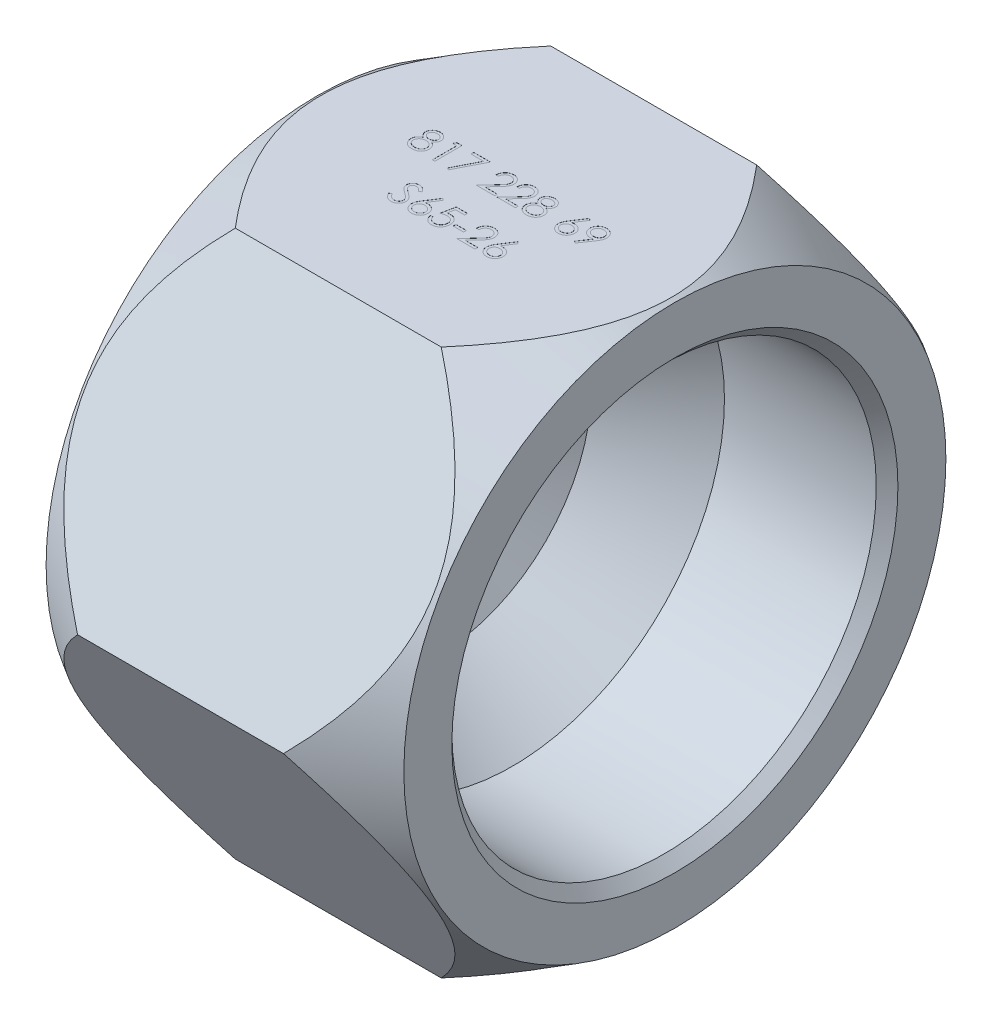
from build123d import *

# Parameters (mm, degrees)
SKETCH2_OUTSIDE_W  = 77.936
SKETCH2_OUTSIDE_H  = 77.936
EXTRUDE1_DEPTH     = 33
CHAMFER1_SIZE      = 1
SKETCH3_W          = 0.961538461
SKETCH3_H          = 0.256410256
CUT_EXTRUDE1_DEPTH = 0.01


with BuildPart() as part:
    # Sketch1 → Revolve1 (revolve)
    with BuildSketch(Plane.XY, mode=Mode.PRIVATE) as revolve1_sk:
        Polygon((0, 0), (0, 25), (7, 29.1), (26, 29.1), (33, 25), (33, 19.575), (18, 19.575), (11, 14.300121649), (3, 0), align=None)
    revolve(revolve1_sk.sketch.rotate(Axis((0, 0, 0), (1, 0, 0)), 90), axis=Axis((0, 0, 0), (1, 0, 0)))

    # Sketch2 outside → Extrude1 (cut)
    with BuildSketch(Plane(origin=(33, 0, 0), x_dir=(0, 0, -1), z_dir=(1, 0, 0))):
        Rectangle(SKETCH2_OUTSIDE_W, SKETCH2_OUTSIDE_H)
        Polygon((14.55, 25.20133925), (-14.55, 25.20133925), (-29.1, 0), (-14.55, -25.20133925), (14.55, -25.20133925), (29.1, 0), align=None, mode=Mode.SUBTRACT)
    extrude(amount=-EXTRUDE1_DEPTH, mode=Mode.SUBTRACT)

    # Chamfer1
    chamfer1_edges = [part.edges().sort_by_distance(p)[0] for p in [
        (33, 0, -19.575),
    ]]
    chamfer(chamfer1_edges, length=CHAMFER1_SIZE)

    # Sketch3 → Cut-Extrude1 (cut)
    # profile 1 of 14: a face of its own
    with BuildSketch(Plane(origin=(0, 25.20133925, 0), x_dir=(1, 0, 0), z_dir=(0, 1, 0))):
        with BuildLine():
            add(Edge.make_bspline(
                [(9.157752404, 1.392728365), (9.178215652, 1.382058397), (9.218125819, 1.361248395), (9.274966682, 1.327740661), (9.326913112, 1.292425686), (9.37540637, 1.256971501), (9.419594478, 1.220020321), (9.458983344, 1.181425209), (9.49454593, 1.142149534), (9.525565061, 1.10152822), (9.552848516, 1.059669185), (9.576428613, 1.016462561), (9.596583758, 0.972003037), (9.612557285, 0.925805301), (9.625715708, 0.878547972), (9.634769712, 0.829620842), (9.639638939, 0.779346312), (9.64055952, 0.745368954), (9.641025641, 0.728165064)],
                knots=[0, 0, 0, 0, 1.272397273, 2.481599622, 3.635517121, 4.734568067, 5.792894095, 6.808321871, 7.773003508, 8.711915296, 9.623354172, 10.525449501, 11.423591555, 12.311487226, 13.218079475, 14.126165749, 15.051214107, 16, 16, 16, 16], degree=3))
            add(Edge.make_bspline(
                [(9.641025641, 0.728165064), (9.640474626, 0.704095255), (9.639383962, 0.656452072), (9.629883973, 0.586133421), (9.615660417, 0.517839291), (9.594889337, 0.451584654), (9.5679512, 0.387735102), (9.53475346, 0.326235978), (9.497174028, 0.266079329), (9.466993857, 0.22906547), (9.451722756, 0.210336538)],
                knots=[0, 0, 0, 0, 1.025265484, 2.029385089, 3.018602448, 3.995076438, 4.983346944, 5.966715145, 6.97116228, 8, 8, 8, 8], degree=3))
            add(Edge.make_bspline(
                [(9.451722756, 0.210336538), (9.43183956, 0.188483843), (9.392318871, 0.145048491), (9.32461678, 0.088655055), (9.250315434, 0.041262631), (9.169702339, 0.002639849), (9.082992981, -0.027421479), (8.990205835, -0.049023277), (8.891160011, -0.061396441), (8.823084675, -0.063185005), (8.788161058, -0.064102564)],
                knots=[0, 0, 0, 0, 0.954267603, 1.896743057, 2.838368354, 3.796610408, 4.779680527, 5.799409237, 6.871065594, 8, 8, 8, 8], degree=3))
            add(Edge.make_bspline(
                [(8.788161058, -0.064102564), (8.754580066, -0.063279366), (8.689234867, -0.061677505), (8.594122097, -0.050824339), (8.505462761, -0.031804435), (8.422741355, -0.005772571), (8.346456574, 0.028091878), (8.276825788, 0.070240741), (8.212844379, 0.118977486), (8.156454041, 0.175701827), (8.106390867, 0.23645745), (8.062413686, 0.299137172), (8.025860773, 0.363746713), (7.994912847, 0.429322689), (7.971221403, 0.496784228), (7.954812681, 0.565784237), (7.944391742, 0.636202197), (7.943005217, 0.683724806), (7.942307692, 0.707632212)],
                knots=[0, 0, 0, 0, 1.256902934, 2.445805442, 3.576955095, 4.645999104, 5.686449165, 6.692658513, 7.68621702, 8.689161843, 9.678783111, 10.630372946, 11.551080876, 12.453998257, 13.34127905, 14.221779781, 15.105423033, 16, 16, 16, 16], degree=3))
            add(Edge.make_bspline(
                [(7.942307692, 0.707632212), (7.942720464, 0.725174492), (7.943536248, 0.759844229), (7.949182568, 0.811065177), (7.95826004, 0.860919559), (7.970588224, 0.909591519), (7.9872961, 0.956726714), (8.007469052, 1.002548481), (8.030991875, 1.047108551), (8.058192708, 1.090650609), (8.08983701, 1.132564547), (8.125668189, 1.173561686), (8.166402381, 1.213005876), (8.211586423, 1.251379037), (8.260703951, 1.289361876), (8.315030759, 1.324901682), (8.373126664, 1.360514514), (8.41441624, 1.381806175), (8.435596955, 1.392728365)],
                knots=[0, 0, 0, 0, 0.941657376, 1.861047343, 2.762797495, 3.66048619, 4.553285746, 5.444104102, 6.34607688, 7.256116206, 8.197091036, 9.162375105, 10.176350973, 11.237807142, 12.343728897, 13.50695164, 14.721116704, 16, 16, 16, 16], degree=3))
            add(Edge.make_bspline(
                [(8.435596955, 1.392728365), (8.406603116, 1.408538914), (8.350462928, 1.439152563), (8.276127613, 1.495400281), (8.212277168, 1.556320149), (8.160666655, 1.623198574), (8.120043635, 1.693946341), (8.092173203, 1.768120807), (8.073318572, 1.844346603), (8.071450838, 1.896422457), (8.070512821, 1.922576122)],
                knots=[0, 0, 0, 0, 1.166880483, 2.259407225, 3.286803203, 4.280235371, 5.237608625, 6.161067461, 7.076446754, 8, 8, 8, 8], degree=3))
            add(Edge.make_bspline(
                [(8.070512821, 1.922576122), (8.071680981, 1.949217235), (8.074029186, 2.002770518), (8.093017272, 2.082489178), (8.123960177, 2.160786724), (8.166046603, 2.237283662), (8.218466043, 2.309390958), (8.281356433, 2.374063063), (8.353215931, 2.430714122), (8.433685836, 2.478268531), (8.520283147, 2.516971144), (8.611651521, 2.543670018), (8.706199017, 2.561124387), (8.77055453, 2.563100569), (8.803185096, 2.564102564)],
                knots=[0, 0, 0, 0, 0.888701115, 1.786444228, 2.72001202, 3.692817113, 4.693886446, 5.687152267, 6.695133018, 7.739871481, 8.800368666, 9.853104506, 10.91144658, 12, 12, 12, 12], degree=3))
            add(Edge.make_bspline(
                [(8.803185096, 2.564102564), (8.834973535, 2.563069462), (8.897656716, 2.561032302), (8.989795736, 2.544041675), (9.077956363, 2.515663446), (9.161834576, 2.47716543), (9.239928767, 2.429746186), (9.308930417, 2.372316991), (9.369882261, 2.307930169), (9.420299685, 2.235844738), (9.461844606, 2.159641742), (9.490773822, 2.07991137), (9.509310946, 1.998376328), (9.511649063, 1.943206325), (9.512820513, 1.915564904)],
                knots=[0, 0, 0, 0, 1.072916533, 2.115669174, 3.151510826, 4.193348718, 5.225979165, 6.227137561, 7.216255879, 8.211077061, 9.189680878, 10.138522389, 11.067357538, 12, 12, 12, 12], degree=3))
            add(Edge.make_bspline(
                [(9.512820513, 1.915564904), (9.511795827, 1.888438715), (9.509783401, 1.835164423), (9.492854873, 1.757502623), (9.464345363, 1.684772595), (9.425420961, 1.616149058), (9.37468847, 1.552876559), (9.312825089, 1.494150509), (9.240324033, 1.439488489), (9.185851972, 1.408641086), (9.157752404, 1.392728365)],
                knots=[0, 0, 0, 0, 0.975232327, 1.915300861, 2.843280834, 3.77672583, 4.742871857, 5.749627742, 6.839139064, 8, 8, 8, 8], degree=3))
        make_face()
        with BuildLine():
            add(Edge.make_bspline(
                [(8.790665064, 2.307692308), (8.773128774, 2.307226993), (8.738820123, 2.306316634), (8.68851393, 2.301560465), (8.640676524, 2.292308167), (8.594808095, 2.279994802), (8.551537515, 2.263360524), (8.510277119, 2.243792661), (8.471729126, 2.220002614), (8.435428196, 2.193316044), (8.402749071, 2.163963968), (8.37374582, 2.13338274), (8.34965431, 2.100971746), (8.329196374, 2.067537203), (8.314352433, 2.032086792), (8.303235073, 1.99570738), (8.295719794, 1.957939249), (8.295156658, 1.932127455), (8.294871795, 1.919070513)],
                knots=[0, 0, 0, 0, 1.203892937, 2.355340988, 3.463153438, 4.544400666, 5.610487187, 6.640501085, 7.674077295, 8.714426146, 9.728707835, 10.68524104, 11.601827946, 12.495867327, 13.368432065, 14.231010473, 15.105153427, 16, 16, 16, 16], degree=3))
            add(Edge.make_bspline(
                [(8.294871795, 1.919070513), (8.295362771, 1.906013006), (8.296333011, 1.880209497), (8.303836674, 1.842105307), (8.315020142, 1.804661281), (8.332627757, 1.768767773), (8.353746584, 1.733179659), (8.379811924, 1.698786383), (8.410875516, 1.665468251), (8.445895116, 1.63350865), (8.484046214, 1.603580962), (8.524463388, 1.577600118), (8.566639382, 1.555861468), (8.61014086, 1.537769036), (8.65541118, 1.523704795), (8.702172946, 1.513727191), (8.750434019, 1.507525764), (8.783134434, 1.506785035), (8.799679487, 1.506410256)],
                knots=[0, 0, 0, 0, 0.873023192, 1.725219244, 2.590779336, 3.480155217, 4.391973325, 5.357036234, 6.360879153, 7.436073238, 8.526419356, 9.601555421, 10.645666583, 11.697338044, 12.750135903, 13.812665442, 14.89329948, 16, 16, 16, 16], degree=3))
            add(Edge.make_bspline(
                [(8.799679487, 1.506410256), (8.820929561, 1.507033733), (8.863219824, 1.508274528), (8.925562204, 1.519811081), (8.986178378, 1.537958165), (9.044420453, 1.562786712), (9.098780871, 1.593949469), (9.147238062, 1.631258768), (9.1893787, 1.673853123), (9.22476485, 1.721069434), (9.252200455, 1.771320569), (9.273558889, 1.821749349), (9.286031186, 1.8728938), (9.287658019, 1.907155917), (9.288461538, 1.924078526)],
                knots=[0, 0, 0, 0, 1.076279235, 2.141928126, 3.20205304, 4.278698113, 5.344010996, 6.36967002, 7.368914609, 8.37248503, 9.349703398, 10.264243087, 11.142681841, 12, 12, 12, 12], degree=3))
            add(Edge.make_bspline(
                [(9.288461538, 1.924078526), (9.288081612, 1.935955694), (9.287327511, 1.959530171), (9.281113186, 1.994343289), (9.270844733, 2.02836442), (9.256942533, 2.061874614), (9.238649823, 2.094403708), (9.216961118, 2.126463057), (9.190615045, 2.157331459), (9.161046164, 2.18772828), (9.127513729, 2.215859725), (9.090082363, 2.240598804), (9.04894397, 2.26160763), (9.004097577, 2.278671026), (8.955708346, 2.29148699), (8.90399915, 2.301084382), (8.848538831, 2.306493747), (8.810374723, 2.307284122), (8.790665064, 2.307692308)],
                knots=[0, 0, 0, 0, 0.814439003, 1.616544685, 2.417341072, 3.248991801, 4.09997495, 4.973547432, 5.9003056, 6.880240646, 7.880314356, 8.896779544, 9.951930927, 11.043077905, 12.18215768, 13.381699519, 14.647792085, 16, 16, 16, 16], degree=3))
        make_face(mode=Mode.SUBTRACT)
        with BuildLine():
            add(Edge.make_bspline(
                [(8.805188301, 1.25), (8.782955597, 1.249604542), (8.739340457, 1.24882875), (8.675442651, 1.240193392), (8.614118962, 1.228172397), (8.55557615, 1.209936084), (8.499838938, 1.186224305), (8.446605593, 1.157699634), (8.396283358, 1.12398146), (8.349567125, 1.085498163), (8.306907603, 1.044027125), (8.269480246, 1.0001256), (8.237696303, 0.954609505), (8.212101124, 0.906900769), (8.191092744, 0.858009619), (8.177297117, 0.806718479), (8.168453038, 0.754013399), (8.167265444, 0.718184757), (8.166666667, 0.700120192)],
                knots=[0, 0, 0, 0, 1.140299081, 2.23698856, 3.303958914, 4.344563908, 5.37730929, 6.408454204, 7.439741482, 8.480804886, 9.510774543, 10.48932336, 11.43758569, 12.353841022, 13.263987381, 14.161954604, 15.073269652, 16, 16, 16, 16], degree=3))
            add(Edge.make_bspline(
                [(8.166666667, 0.700120192), (8.167640423, 0.677669545), (8.169572333, 0.633127986), (8.184898503, 0.56729722), (8.209495314, 0.503567895), (8.24379904, 0.442459358), (8.286275877, 0.385352139), (8.338509069, 0.335574442), (8.397252524, 0.291344815), (8.464493849, 0.255573005), (8.537942753, 0.227005251), (8.617579702, 0.207322421), (8.702261787, 0.194292814), (8.760732924, 0.192979827), (8.790665064, 0.192307692)],
                knots=[0, 0, 0, 0, 0.898778495, 1.783155532, 2.693654817, 3.627872908, 4.583023416, 5.533784346, 6.509005473, 7.520592997, 8.575161974, 9.658835044, 10.801527049, 12, 12, 12, 12], degree=3))
            add(Edge.make_bspline(
                [(8.790665064, 0.192307692), (8.814058184, 0.192756841), (8.859635483, 0.193631927), (8.926125447, 0.201356423), (8.988871553, 0.213606155), (9.047752123, 0.231422973), (9.103426295, 0.253172957), (9.154950119, 0.281153015), (9.203649067, 0.312976103), (9.24712344, 0.350731929), (9.286718589, 0.391074425), (9.32124237, 0.433781599), (9.351212049, 0.477692765), (9.37473416, 0.523800254), (9.393538627, 0.571219479), (9.407055452, 0.620387701), (9.415395606, 0.671455724), (9.416239103, 0.706097918), (9.416666667, 0.723657853)],
                knots=[0, 0, 0, 0, 1.224942928, 2.386581632, 3.501229538, 4.569074225, 5.605009692, 6.626002462, 7.634866581, 8.645888296, 9.63523824, 10.59253846, 11.518950513, 12.414518923, 13.29783783, 14.186679152, 15.080837789, 16, 16, 16, 16], degree=3))
            add(Edge.make_bspline(
                [(9.416666667, 0.723657853), (9.416019632, 0.740713096), (9.414743793, 0.774343056), (9.406646156, 0.82417629), (9.392420529, 0.872321157), (9.37290096, 0.919356875), (9.346914558, 0.964330412), (9.31631108, 1.008413391), (9.279386709, 1.05038228), (9.237663426, 1.090563063), (9.19219274, 1.127717161), (9.143859065, 1.160584617), (9.093034449, 1.1882647), (9.039826442, 1.210776482), (8.984353187, 1.228481818), (8.926655488, 1.240850386), (8.866665792, 1.248635816), (8.825912313, 1.249540135), (8.805188301, 1.25)],
                knots=[0, 0, 0, 0, 0.917430815, 1.809013306, 2.70690318, 3.612392954, 4.541220862, 5.495268465, 6.494511384, 7.542276156, 8.608045339, 9.649016899, 10.681629292, 11.715607085, 12.752076957, 13.808767841, 14.885711793, 16, 16, 16, 16], degree=3))
        make_face(mode=Mode.SUBTRACT)
    # profile 2 of 14: a face of its own
    with BuildSketch(Plane(origin=(0, 25.20133925, 0), x_dir=(1, 0, 0), z_dir=(0, 1, 0))):
        Polygon((10.396734776, 2.5), (10.858974359, 2.5), (10.858974359, 0), (10.634615385, 0), (10.634615385, 2.243589744), (10.25, 2.243589744), align=None)
    # profile 3 of 14: a face of its own
    with BuildSketch(Plane(origin=(0, 25.20133925, 0), x_dir=(1, 0, 0), z_dir=(0, 1, 0))):
        Polygon((11.948717949, 2.5), (13.487179487, 2.5), (12.173076923, -0.064102564), (11.979266827, 0.042568109), (13.107071314, 2.243589744), (11.948717949, 2.243589744), align=None)
    # profile 4 of 14: a face of its own
    with BuildSketch(Plane(origin=(0, 25.20133925, 0), x_dir=(1, 0, 0), z_dir=(0, 1, 0))):
        with BuildLine():
            Line((14.993589744, 1.730769231), (14.769230769, 1.730769231))
            add(Edge.make_bspline(
                [(14.769230769, 1.730769231), (14.770693021, 1.760534151), (14.773564846, 1.818991661), (14.787013624, 1.904223023), (14.806257107, 1.985690736), (14.833465289, 2.062740675), (14.867255487, 2.136054108), (14.907776935, 2.205339834), (14.955772543, 2.27033354), (15.010205924, 2.330432714), (15.069326381, 2.385566693), (15.133116338, 2.433177581), (15.2001485, 2.473404489), (15.270219499, 2.507033947), (15.344119902, 2.532276694), (15.421179086, 2.551006437), (15.501735612, 2.562275255), (15.556621342, 2.563486531), (15.584535256, 2.564102564)],
                knots=[0, 0, 0, 0, 1.10065271, 2.161652631, 3.183658789, 4.190468796, 5.17591951, 6.163126047, 7.15150782, 8.156236427, 9.156009102, 10.134482811, 11.092018607, 12.041330605, 13.001268258, 13.972401359, 14.968799086, 16, 16, 16, 16], degree=3))
            add(Edge.make_bspline(
                [(15.584535256, 2.564102564), (15.611948166, 2.563460809), (15.665813556, 2.562199785), (15.74442928, 2.551370478), (15.819270205, 2.534409341), (15.890190038, 2.510612615), (15.956622941, 2.478623738), (16.019067973, 2.440196925), (16.078268552, 2.395754188), (16.131559112, 2.343430036), (16.180493454, 2.28757119), (16.222709351, 2.227936973), (16.25886161, 2.166344626), (16.288995667, 2.102324482), (16.311178624, 2.035273748), (16.328020201, 1.966168603), (16.337539782, 1.894293738), (16.339000799, 1.845646198), (16.33974359, 1.820913462)],
                knots=[0, 0, 0, 0, 1.111607364, 2.184268762, 3.212621178, 4.221274766, 5.211760367, 6.196651075, 7.1921475, 8.207485113, 9.220403448, 10.201281604, 11.166441695, 12.114753415, 13.065576456, 14.026450734, 14.996634279, 16, 16, 16, 16], degree=3))
            add(Edge.make_bspline(
                [(16.33974359, 1.820913462), (16.338538843, 1.786092169), (16.336150492, 1.717060649), (16.315539276, 1.615486108), (16.283694921, 1.516982494), (16.245071329, 1.437711743), (16.206056638, 1.374156819), (16.171642498, 1.321359932), (16.130462246, 1.265055349), (16.082892665, 1.204675986), (16.029651375, 1.14003715), (15.970355183, 1.071112317), (15.904551119, 0.998633528), (15.858366703, 0.949129375), (15.834435096, 0.923477564)],
                knots=[0, 0, 0, 0, 1.184203166, 2.347625244, 3.513805382, 4.700623107, 5.337941753, 6.051866363, 6.845199593, 7.711357327, 8.668078039, 9.695487809, 10.805859518, 12, 12, 12, 12], degree=3))
            Line((15.834435096, 0.923477564), (15.208934295, 0.256410256))
            Line((15.208934295, 0.256410256), (16.371794872, 0.256410256))
            Line((16.371794872, 0.256410256), (16.371794872, 0))
            Line((16.371794872, 0), (14.673076923, 0))
            Line((14.673076923, 0), (15.642628205, 1.034655449))
            add(Edge.make_bspline(
                [(15.642628205, 1.034655449), (15.666233839, 1.059297096), (15.711575429, 1.106628658), (15.775705841, 1.175730772), (15.833305119, 1.239837587), (15.884746114, 1.298827979), (15.928912903, 1.353564813), (15.968107355, 1.402275316), (15.999511348, 1.447099923), (16.033593774, 1.499057504), (16.06660376, 1.562494874), (16.094969729, 1.640018938), (16.112266049, 1.719824118), (16.114340932, 1.773754145), (16.115384615, 1.80088141)],
                knots=[0, 0, 0, 0, 1.329631726, 2.553950428, 3.673215718, 4.687767853, 5.603093632, 6.413772471, 7.123043292, 7.734684054, 8.834405432, 9.900288307, 10.943827018, 12, 12, 12, 12], degree=3))
            add(Edge.make_bspline(
                [(16.115384615, 1.80088141), (16.114930514, 1.817939552), (16.114035567, 1.851557874), (16.106137211, 1.900847702), (16.094201135, 1.948393997), (16.07709738, 1.994343011), (16.054521137, 2.038232762), (16.027040151, 2.080116677), (15.995332963, 2.120608795), (15.958653485, 2.158575436), (15.918359542, 2.193347726), (15.875792221, 2.224150644), (15.830756432, 2.249892866), (15.783442059, 2.270995364), (15.73398101, 2.287549208), (15.68227762, 2.299019622), (15.628474752, 2.306221396), (15.59173654, 2.307195804), (15.573016827, 2.307692308)],
                knots=[0, 0, 0, 0, 0.991446411, 1.95395049, 2.89581595, 3.838931463, 4.798493298, 5.75982156, 6.748411868, 7.785213223, 8.824556874, 9.840280684, 10.836137867, 11.835679398, 12.848801643, 13.863922112, 14.911575587, 16, 16, 16, 16], degree=3))
            add(Edge.make_bspline(
                [(15.573016827, 2.307692308), (15.553466232, 2.30718157), (15.515072092, 2.306178567), (15.458701354, 2.299162378), (15.404925799, 2.287058206), (15.353610154, 2.270503439), (15.304667592, 2.249461618), (15.258336132, 2.223253229), (15.214719783, 2.191979306), (15.173736552, 2.156521765), (15.135976567, 2.117044907), (15.102800227, 2.073037791), (15.073811646, 2.025303923), (15.048519336, 1.973972101), (15.027979557, 1.918576544), (15.01228445, 1.859313897), (14.999865274, 1.796441482), (14.99571633, 1.753023564), (14.993589744, 1.730769231)],
                knots=[0, 0, 0, 0, 1.031018746, 2.02475058, 2.990194455, 3.934040569, 4.864654155, 5.795059489, 6.735614925, 7.690564532, 8.649604399, 9.611025574, 10.590972636, 11.591080095, 12.624614302, 13.701020113, 14.821632451, 16, 16, 16, 16], degree=3))
        make_face()
    # profile 5 of 14: a face of its own
    with BuildSketch(Plane(origin=(0, 25.20133925, 0), x_dir=(1, 0, 0), z_dir=(0, 1, 0))):
        with BuildLine():
            Line((16.916666667, 1.730769231), (16.692307692, 1.730769231))
            add(Edge.make_bspline(
                [(16.692307692, 1.730769231), (16.693769944, 1.760534151), (16.696641769, 1.818991661), (16.710090547, 1.904223023), (16.729334031, 1.985690736), (16.756542212, 2.062740675), (16.79033241, 2.136054108), (16.830853858, 2.205339834), (16.878849466, 2.27033354), (16.933282847, 2.330432714), (16.992403304, 2.385566693), (17.056193261, 2.433177581), (17.123225423, 2.473404489), (17.193296422, 2.507033947), (17.267196825, 2.532276694), (17.344256009, 2.551006437), (17.424812535, 2.562275255), (17.479698265, 2.563486531), (17.507612179, 2.564102564)],
                knots=[0, 0, 0, 0, 1.10065271, 2.161652631, 3.183658789, 4.190468796, 5.17591951, 6.163126047, 7.15150782, 8.156236427, 9.156009102, 10.134482811, 11.092018607, 12.041330605, 13.001268258, 13.972401359, 14.968799086, 16, 16, 16, 16], degree=3))
            add(Edge.make_bspline(
                [(17.507612179, 2.564102564), (17.53502509, 2.563460809), (17.588890479, 2.562199785), (17.667506203, 2.551370478), (17.742347128, 2.534409341), (17.813266961, 2.510612615), (17.879699864, 2.478623738), (17.942144896, 2.440196925), (18.001345475, 2.395754188), (18.054636035, 2.343430036), (18.103570377, 2.28757119), (18.145786274, 2.227936973), (18.181938533, 2.166344626), (18.212072591, 2.102324482), (18.234255547, 2.035273748), (18.251097124, 1.966168603), (18.260616705, 1.894293738), (18.262077722, 1.845646198), (18.262820513, 1.820913462)],
                knots=[0, 0, 0, 0, 1.111607364, 2.184268762, 3.212621178, 4.221274766, 5.211760367, 6.196651075, 7.1921475, 8.207485113, 9.220403448, 10.201281604, 11.166441695, 12.114753415, 13.065576456, 14.026450734, 14.996634279, 16, 16, 16, 16], degree=3))
            add(Edge.make_bspline(
                [(18.262820513, 1.820913462), (18.261615766, 1.786092169), (18.259227415, 1.717060649), (18.238616199, 1.615486108), (18.206771844, 1.516982494), (18.168148252, 1.437711743), (18.129133561, 1.374156819), (18.094719421, 1.321359932), (18.053539169, 1.265055349), (18.005969588, 1.204675986), (17.952728298, 1.14003715), (17.893432107, 1.071112317), (17.827628042, 0.998633528), (17.781443626, 0.949129375), (17.757512019, 0.923477564)],
                knots=[0, 0, 0, 0, 1.184203166, 2.347625244, 3.513805382, 4.700623107, 5.337941753, 6.051866363, 6.845199593, 7.711357327, 8.668078039, 9.695487809, 10.805859518, 12, 12, 12, 12], degree=3))
            Line((17.757512019, 0.923477564), (17.132011218, 0.256410256))
            Line((17.132011218, 0.256410256), (18.294871795, 0.256410256))
            Line((18.294871795, 0.256410256), (18.294871795, 0))
            Line((18.294871795, 0), (16.596153846, 0))
            Line((16.596153846, 0), (17.565705128, 1.034655449))
            add(Edge.make_bspline(
                [(17.565705128, 1.034655449), (17.589310762, 1.059297096), (17.634652352, 1.106628658), (17.698782764, 1.175730772), (17.756382042, 1.239837587), (17.807823037, 1.298827979), (17.851989826, 1.353564813), (17.891184278, 1.402275316), (17.922588271, 1.447099923), (17.956670697, 1.499057504), (17.989680683, 1.562494874), (18.018046652, 1.640018938), (18.035342972, 1.719824118), (18.037417855, 1.773754145), (18.038461538, 1.80088141)],
                knots=[0, 0, 0, 0, 1.329631726, 2.553950428, 3.673215718, 4.687767853, 5.603093632, 6.413772471, 7.123043292, 7.734684054, 8.834405432, 9.900288307, 10.943827018, 12, 12, 12, 12], degree=3))
            add(Edge.make_bspline(
                [(18.038461538, 1.80088141), (18.038007437, 1.817939552), (18.03711249, 1.851557874), (18.029214134, 1.900847702), (18.017278059, 1.948393997), (18.000174303, 1.994343011), (17.97759806, 2.038232762), (17.950117074, 2.080116677), (17.918409886, 2.120608795), (17.881730408, 2.158575436), (17.841436465, 2.193347726), (17.798869144, 2.224150644), (17.753833355, 2.249892866), (17.706518982, 2.270995364), (17.657057933, 2.287549208), (17.605354543, 2.299019622), (17.551551675, 2.306221396), (17.514813463, 2.307195804), (17.49609375, 2.307692308)],
                knots=[0, 0, 0, 0, 0.991446411, 1.95395049, 2.89581595, 3.838931463, 4.798493298, 5.75982156, 6.748411868, 7.785213223, 8.824556874, 9.840280684, 10.836137867, 11.835679398, 12.848801643, 13.863922112, 14.911575587, 16, 16, 16, 16], degree=3))
            add(Edge.make_bspline(
                [(17.49609375, 2.307692308), (17.476543155, 2.30718157), (17.438149015, 2.306178567), (17.381778277, 2.299162378), (17.328002722, 2.287058206), (17.276687077, 2.270503439), (17.227744516, 2.249461618), (17.181413056, 2.223253229), (17.137796706, 2.191979306), (17.096813475, 2.156521765), (17.05905349, 2.117044907), (17.02587715, 2.073037791), (16.996888569, 2.025303923), (16.971596259, 1.973972101), (16.95105648, 1.918576544), (16.935361373, 1.859313897), (16.922942197, 1.796441482), (16.918793253, 1.753023564), (16.916666667, 1.730769231)],
                knots=[0, 0, 0, 0, 1.031018746, 2.02475058, 2.990194455, 3.934040569, 4.864654155, 5.795059489, 6.735614925, 7.690564532, 8.649604399, 9.611025574, 10.590972636, 11.591080095, 12.624614302, 13.701020113, 14.821632451, 16, 16, 16, 16], degree=3))
        make_face()
    # profile 6 of 14: a face of its own
    with BuildSketch(Plane(origin=(0, 25.20133925, 0), x_dir=(1, 0, 0), z_dir=(0, 1, 0))):
        with BuildLine():
            add(Edge.make_bspline(
                [(19.734675481, 1.392728365), (19.755138729, 1.382058397), (19.795048896, 1.361248395), (19.851889759, 1.327740661), (19.903836189, 1.292425686), (19.952329447, 1.256971501), (19.996517555, 1.220020321), (20.035906421, 1.181425209), (20.071469007, 1.142149534), (20.102488138, 1.10152822), (20.129771593, 1.059669185), (20.15335169, 1.016462561), (20.173506835, 0.972003037), (20.189480362, 0.925805301), (20.202638785, 0.878547972), (20.211692788, 0.829620842), (20.216562015, 0.779346312), (20.217482597, 0.745368954), (20.217948718, 0.728165064)],
                knots=[0, 0, 0, 0, 1.272397273, 2.481599622, 3.635517121, 4.734568067, 5.792894095, 6.808321871, 7.773003508, 8.711915296, 9.623354172, 10.525449501, 11.423591555, 12.311487226, 13.218079475, 14.126165749, 15.051214107, 16, 16, 16, 16], degree=3))
            add(Edge.make_bspline(
                [(20.217948718, 0.728165064), (20.217397703, 0.704095255), (20.216307038, 0.656452072), (20.20680705, 0.586133421), (20.192583494, 0.517839291), (20.171812414, 0.451584654), (20.144874277, 0.387735102), (20.111676537, 0.326235978), (20.074097105, 0.266079329), (20.043916934, 0.22906547), (20.028645833, 0.210336538)],
                knots=[0, 0, 0, 0, 1.025265484, 2.029385089, 3.018602448, 3.995076438, 4.983346944, 5.966715145, 6.97116228, 8, 8, 8, 8], degree=3))
            add(Edge.make_bspline(
                [(20.028645833, 0.210336538), (20.008762637, 0.188483843), (19.969241948, 0.145048491), (19.901539857, 0.088655055), (19.827238511, 0.041262631), (19.746625416, 0.002639849), (19.659916058, -0.027421479), (19.567128912, -0.049023277), (19.468083088, -0.061396441), (19.400007752, -0.063185005), (19.365084135, -0.064102564)],
                knots=[0, 0, 0, 0, 0.954267603, 1.896743057, 2.838368354, 3.796610408, 4.779680527, 5.799409237, 6.871065594, 8, 8, 8, 8], degree=3))
            add(Edge.make_bspline(
                [(19.365084135, -0.064102564), (19.331503143, -0.063279366), (19.266157943, -0.061677505), (19.171045174, -0.050824339), (19.082385838, -0.031804435), (18.999664432, -0.005772571), (18.923379651, 0.028091878), (18.853748865, 0.070240741), (18.789767456, 0.118977486), (18.733377118, 0.175701827), (18.683313944, 0.23645745), (18.639336763, 0.299137172), (18.60278385, 0.363746713), (18.571835924, 0.429322689), (18.54814448, 0.496784228), (18.531735758, 0.565784237), (18.521314819, 0.636202197), (18.519928294, 0.683724806), (18.519230769, 0.707632212)],
                knots=[0, 0, 0, 0, 1.256902934, 2.445805442, 3.576955095, 4.645999104, 5.686449165, 6.692658513, 7.68621702, 8.689161843, 9.678783111, 10.630372946, 11.551080876, 12.453998257, 13.34127905, 14.221779781, 15.105423033, 16, 16, 16, 16], degree=3))
            add(Edge.make_bspline(
                [(18.519230769, 0.707632212), (18.519643541, 0.725174492), (18.520459325, 0.759844229), (18.526105645, 0.811065177), (18.535183117, 0.860919559), (18.547511301, 0.909591519), (18.564219177, 0.956726714), (18.584392129, 1.002548481), (18.607914952, 1.047108551), (18.635115785, 1.090650609), (18.666760087, 1.132564547), (18.702591266, 1.173561686), (18.743325458, 1.213005876), (18.7885095, 1.251379037), (18.837627028, 1.289361876), (18.891953835, 1.324901682), (18.950049741, 1.360514514), (18.991339316, 1.381806175), (19.012520032, 1.392728365)],
                knots=[0, 0, 0, 0, 0.941657376, 1.861047343, 2.762797495, 3.66048619, 4.553285746, 5.444104102, 6.34607688, 7.256116206, 8.197091036, 9.162375105, 10.176350973, 11.237807142, 12.343728897, 13.50695164, 14.721116704, 16, 16, 16, 16], degree=3))
            add(Edge.make_bspline(
                [(19.012520032, 1.392728365), (18.983526193, 1.408538914), (18.927386005, 1.439152563), (18.85305069, 1.495400281), (18.789200245, 1.556320149), (18.737589732, 1.623198574), (18.696966712, 1.693946341), (18.66909628, 1.768120807), (18.650241649, 1.844346603), (18.648373915, 1.896422457), (18.647435897, 1.922576122)],
                knots=[0, 0, 0, 0, 1.166880483, 2.259407225, 3.286803203, 4.280235371, 5.237608625, 6.161067461, 7.076446754, 8, 8, 8, 8], degree=3))
            add(Edge.make_bspline(
                [(18.647435897, 1.922576122), (18.648604058, 1.949217235), (18.650952263, 2.002770518), (18.669940349, 2.082489178), (18.700883254, 2.160786724), (18.74296968, 2.237283662), (18.79538912, 2.309390958), (18.85827951, 2.374063063), (18.930139008, 2.430714122), (19.010608913, 2.478268531), (19.097206224, 2.516971144), (19.188574598, 2.543670018), (19.283122093, 2.561124387), (19.347477607, 2.563100569), (19.380108173, 2.564102564)],
                knots=[0, 0, 0, 0, 0.888701115, 1.786444228, 2.72001202, 3.692817113, 4.693886446, 5.687152267, 6.695133018, 7.739871481, 8.800368666, 9.853104506, 10.91144658, 12, 12, 12, 12], degree=3))
            add(Edge.make_bspline(
                [(19.380108173, 2.564102564), (19.411896612, 2.563069462), (19.474579793, 2.561032302), (19.566718813, 2.544041675), (19.65487944, 2.515663446), (19.738757653, 2.47716543), (19.816851844, 2.429746186), (19.885853494, 2.372316991), (19.946805338, 2.307930169), (19.997222762, 2.235844738), (20.038767683, 2.159641742), (20.067696898, 2.07991137), (20.086234023, 1.998376328), (20.08857214, 1.943206325), (20.08974359, 1.915564904)],
                knots=[0, 0, 0, 0, 1.072916533, 2.115669174, 3.151510826, 4.193348718, 5.225979165, 6.227137561, 7.216255879, 8.211077061, 9.189680878, 10.138522389, 11.067357538, 12, 12, 12, 12], degree=3))
            add(Edge.make_bspline(
                [(20.08974359, 1.915564904), (20.088718904, 1.888438715), (20.086706478, 1.835164423), (20.06977795, 1.757502623), (20.04126844, 1.684772595), (20.002344038, 1.616149058), (19.951611547, 1.552876559), (19.889748166, 1.494150509), (19.81724711, 1.439488489), (19.762775049, 1.408641086), (19.734675481, 1.392728365)],
                knots=[0, 0, 0, 0, 0.975232327, 1.915300861, 2.843280834, 3.77672583, 4.742871857, 5.749627742, 6.839139064, 8, 8, 8, 8], degree=3))
        make_face()
        with BuildLine():
            add(Edge.make_bspline(
                [(19.367588141, 2.307692308), (19.350051851, 2.307226993), (19.3157432, 2.306316634), (19.265437007, 2.301560465), (19.217599601, 2.292308167), (19.171731172, 2.279994802), (19.128460592, 2.263360524), (19.087200196, 2.243792661), (19.048652203, 2.220002614), (19.012351273, 2.193316044), (18.979672148, 2.163963968), (18.950668897, 2.13338274), (18.926577387, 2.100971746), (18.906119451, 2.067537203), (18.89127551, 2.032086792), (18.88015815, 1.99570738), (18.872642871, 1.957939249), (18.872079735, 1.932127455), (18.871794872, 1.919070513)],
                knots=[0, 0, 0, 0, 1.203892937, 2.355340988, 3.463153438, 4.544400666, 5.610487187, 6.640501085, 7.674077295, 8.714426146, 9.728707835, 10.68524104, 11.601827946, 12.495867327, 13.368432065, 14.231010473, 15.105153427, 16, 16, 16, 16], degree=3))
            add(Edge.make_bspline(
                [(18.871794872, 1.919070513), (18.872285848, 1.906013006), (18.873256088, 1.880209497), (18.880759751, 1.842105307), (18.891943219, 1.804661281), (18.909550834, 1.768767773), (18.930669661, 1.733179659), (18.956735001, 1.698786383), (18.987798593, 1.665468251), (19.022818193, 1.63350865), (19.060969291, 1.603580962), (19.101386465, 1.577600118), (19.143562459, 1.555861468), (19.187063937, 1.537769036), (19.232334256, 1.523704795), (19.279096023, 1.513727191), (19.327357096, 1.507525764), (19.360057511, 1.506785035), (19.376602564, 1.506410256)],
                knots=[0, 0, 0, 0, 0.873023192, 1.725219244, 2.590779336, 3.480155217, 4.391973325, 5.357036234, 6.360879153, 7.436073238, 8.526419356, 9.601555421, 10.645666583, 11.697338044, 12.750135903, 13.812665442, 14.89329948, 16, 16, 16, 16], degree=3))
            add(Edge.make_bspline(
                [(19.376602564, 1.506410256), (19.397852638, 1.507033733), (19.440142901, 1.508274528), (19.502485281, 1.519811081), (19.563101455, 1.537958165), (19.62134353, 1.562786712), (19.675703948, 1.593949469), (19.724161139, 1.631258768), (19.766301777, 1.673853123), (19.801687927, 1.721069434), (19.829123532, 1.771320569), (19.850481966, 1.821749349), (19.862954263, 1.8728938), (19.864581096, 1.907155917), (19.865384615, 1.924078526)],
                knots=[0, 0, 0, 0, 1.076279235, 2.141928126, 3.20205304, 4.278698113, 5.344010996, 6.36967002, 7.368914609, 8.37248503, 9.349703398, 10.264243087, 11.142681841, 12, 12, 12, 12], degree=3))
            add(Edge.make_bspline(
                [(19.865384615, 1.924078526), (19.865004689, 1.935955694), (19.864250588, 1.959530171), (19.858036263, 1.994343289), (19.84776781, 2.02836442), (19.83386561, 2.061874614), (19.8155729, 2.094403708), (19.793884194, 2.126463057), (19.767538122, 2.157331459), (19.737969241, 2.18772828), (19.704436806, 2.215859725), (19.66700544, 2.240598804), (19.625867047, 2.26160763), (19.581020654, 2.278671026), (19.532631423, 2.29148699), (19.480922227, 2.301084382), (19.425461908, 2.306493747), (19.3872978, 2.307284122), (19.367588141, 2.307692308)],
                knots=[0, 0, 0, 0, 0.814439003, 1.616544685, 2.417341072, 3.248991801, 4.09997495, 4.973547432, 5.9003056, 6.880240646, 7.880314356, 8.896779544, 9.951930927, 11.043077905, 12.18215768, 13.381699519, 14.647792085, 16, 16, 16, 16], degree=3))
        make_face(mode=Mode.SUBTRACT)
        with BuildLine():
            add(Edge.make_bspline(
                [(19.382111378, 1.25), (19.359878674, 1.249604542), (19.316263534, 1.24882875), (19.252365728, 1.240193392), (19.191042038, 1.228172397), (19.132499227, 1.209936084), (19.076762015, 1.186224305), (19.02352867, 1.157699634), (18.973206435, 1.12398146), (18.926490201, 1.085498163), (18.88383068, 1.044027125), (18.846403323, 1.0001256), (18.81461938, 0.954609505), (18.789024201, 0.906900769), (18.768015821, 0.858009619), (18.754220194, 0.806718479), (18.745376115, 0.754013399), (18.744188521, 0.718184757), (18.743589744, 0.700120192)],
                knots=[0, 0, 0, 0, 1.140299081, 2.23698856, 3.303958914, 4.344563908, 5.37730929, 6.408454204, 7.439741482, 8.480804886, 9.510774543, 10.48932336, 11.43758569, 12.353841022, 13.263987381, 14.161954604, 15.073269652, 16, 16, 16, 16], degree=3))
            add(Edge.make_bspline(
                [(18.743589744, 0.700120192), (18.7445635, 0.677669545), (18.74649541, 0.633127986), (18.76182158, 0.56729722), (18.786418391, 0.503567895), (18.820722117, 0.442459358), (18.863198954, 0.385352139), (18.915432146, 0.335574442), (18.974175601, 0.291344815), (19.041416926, 0.255573005), (19.11486583, 0.227005251), (19.194502779, 0.207322421), (19.279184864, 0.194292814), (19.337656001, 0.192979827), (19.367588141, 0.192307692)],
                knots=[0, 0, 0, 0, 0.898778495, 1.783155532, 2.693654817, 3.627872908, 4.583023416, 5.533784346, 6.509005473, 7.520592997, 8.575161974, 9.658835044, 10.801527049, 12, 12, 12, 12], degree=3))
            add(Edge.make_bspline(
                [(19.367588141, 0.192307692), (19.390981261, 0.192756841), (19.43655856, 0.193631927), (19.503048524, 0.201356423), (19.56579463, 0.213606155), (19.6246752, 0.231422973), (19.680349371, 0.253172957), (19.731873196, 0.281153015), (19.780572144, 0.312976103), (19.824046517, 0.350731929), (19.863641666, 0.391074425), (19.898165447, 0.433781599), (19.928135126, 0.477692765), (19.951657237, 0.523800254), (19.970461704, 0.571219479), (19.983978529, 0.620387701), (19.992318683, 0.671455724), (19.99316218, 0.706097918), (19.993589744, 0.723657853)],
                knots=[0, 0, 0, 0, 1.224942928, 2.386581632, 3.501229538, 4.569074225, 5.605009692, 6.626002462, 7.634866581, 8.645888296, 9.63523824, 10.59253846, 11.518950513, 12.414518923, 13.29783783, 14.186679152, 15.080837789, 16, 16, 16, 16], degree=3))
            add(Edge.make_bspline(
                [(19.993589744, 0.723657853), (19.992942709, 0.740713096), (19.99166687, 0.774343056), (19.983569233, 0.82417629), (19.969343606, 0.872321157), (19.949824037, 0.919356875), (19.923837635, 0.964330412), (19.893234157, 1.008413391), (19.856309786, 1.05038228), (19.814586503, 1.090563063), (19.769115817, 1.127717161), (19.720782142, 1.160584617), (19.669957526, 1.1882647), (19.616749519, 1.210776482), (19.561276264, 1.228481818), (19.503578565, 1.240850386), (19.443588869, 1.248635816), (19.40283539, 1.249540135), (19.382111378, 1.25)],
                knots=[0, 0, 0, 0, 0.917430815, 1.809013306, 2.70690318, 3.612392954, 4.541220862, 5.495268465, 6.494511384, 7.542276156, 8.608045339, 9.649016899, 10.681629292, 11.715607085, 12.752076957, 13.808767841, 14.885711793, 16, 16, 16, 16], degree=3))
        make_face(mode=Mode.SUBTRACT)
    # profile 7 of 14: a face of its own
    with BuildSketch(Plane(origin=(0, 25.20133925, 0), x_dir=(1, 0, 0), z_dir=(0, 1, 0))):
        with BuildLine():
            Line((22.557692308, 2.564102564), (22.730969551, 2.428385417))
            Line((22.730969551, 2.428385417), (22.07041266, 1.418269231))
            add(Edge.make_bspline(
                [(22.07041266, 1.418269231), (22.11439143, 1.425279131), (22.200176992, 1.438952735), (22.287009776, 1.44120841), (22.329326923, 1.442307692)],
                knots=[0, 0, 0, 0, 1.025318673, 2, 2, 2, 2], degree=3))
            add(Edge.make_bspline(
                [(22.329326923, 1.442307692), (22.354737128, 1.441634647), (22.40459092, 1.440314158), (22.477844087, 1.429878744), (22.548249367, 1.41363608), (22.615649698, 1.389863953), (22.680130618, 1.359506787), (22.742060841, 1.32312143), (22.800276579, 1.278831782), (22.855527417, 1.229356779), (22.905689631, 1.174558942), (22.950101098, 1.116415128), (22.98740595, 1.054985928), (23.017673037, 0.990302452), (23.041176521, 0.922464409), (23.058310554, 0.851558595), (23.068438834, 0.777536116), (23.069814185, 0.727194562), (23.070512821, 0.701622596)],
                knots=[0, 0, 0, 0, 1.044136307, 2.048553127, 3.035567123, 4.010001674, 4.980053131, 5.96154148, 6.956538004, 7.981742224, 9.006487041, 10.005615874, 10.984750588, 11.954802044, 12.935714515, 13.930994945, 14.949008866, 16, 16, 16, 16], degree=3))
            add(Edge.make_bspline(
                [(23.070512821, 0.701622596), (23.069496317, 0.666637093), (23.067496079, 0.597793903), (23.047564796, 0.497524827), (23.016593621, 0.402001602), (22.972323958, 0.312749337), (22.917336541, 0.229890358), (22.850281118, 0.156472169), (22.773535769, 0.090993571), (22.686759485, 0.036238843), (22.593371653, -0.008477622), (22.495263084, -0.040595652), (22.393386551, -0.060369559), (22.324240402, -0.062848561), (22.289262821, -0.064102564)],
                knots=[0, 0, 0, 0, 1.031375318, 2.029502543, 3.004789286, 3.987476834, 4.960371455, 5.9300674, 6.912260825, 7.929083631, 8.949397511, 9.960523116, 10.96833055, 12, 12, 12, 12], degree=3))
            add(Edge.make_bspline(
                [(22.289262821, -0.064102564), (22.25562232, -0.063010989), (22.188986379, -0.060848769), (22.090962954, -0.041587384), (21.996775085, -0.010368025), (21.90708267, 0.032642174), (21.823996518, 0.086969233), (21.74966392, 0.152370861), (21.68445551, 0.22744905), (21.630187923, 0.312192155), (21.587145972, 0.403256411), (21.554867454, 0.498211523), (21.536012995, 0.596711509), (21.533378311, 0.663483752), (21.532051282, 0.697115385)],
                knots=[0, 0, 0, 0, 1.012016664, 2.004627821, 2.994792927, 3.992885782, 4.990978636, 5.973936114, 6.964471063, 7.975201453, 8.993600317, 9.990122807, 10.98767138, 12, 12, 12, 12], degree=3))
            add(Edge.make_bspline(
                [(21.532051282, 0.697115385), (21.532895171, 0.722861515), (21.534618232, 0.775430195), (21.546649225, 0.855047358), (21.565981221, 0.936512417), (21.587631397, 1.005622555), (21.610506833, 1.062237928), (21.629544361, 1.107883278), (21.653240073, 1.154855473), (21.678506774, 1.204765213), (21.707618823, 1.256326237), (21.739272858, 1.310400286), (21.774344037, 1.366127378), (21.798929868, 1.40394466), (21.811498397, 1.423277244)],
                knots=[0, 0, 0, 0, 1.173818275, 2.396712641, 3.66331629, 4.989737886, 5.693666774, 6.447286557, 7.243889047, 8.091586357, 8.998013824, 9.943181721, 10.948533338, 12, 12, 12, 12], degree=3))
            Line((21.811498397, 1.423277244), (22.557692308, 2.564102564))
        make_face()
        with BuildLine():
            add(Edge.make_bspline(
                [(22.282251603, 1.185897436), (22.263207751, 1.185334316), (22.225843871, 1.184229478), (22.171094615, 1.177989672), (22.119418642, 1.166165959), (22.07022231, 1.15087487), (22.024030729, 1.130043344), (21.980271269, 1.105081259), (21.939447577, 1.07517449), (21.901758933, 1.041413123), (21.867605917, 1.004415053), (21.838189812, 0.964795688), (21.812816931, 0.923499383), (21.792186991, 0.880183827), (21.77612267, 0.834864867), (21.764502486, 0.787751126), (21.758035522, 0.73852662), (21.756959642, 0.705146261), (21.756410256, 0.688100962)],
                knots=[0, 0, 0, 0, 1.128956033, 2.215002439, 3.259141796, 4.2666399, 5.263148119, 6.255916712, 7.247353359, 8.256307737, 9.250603402, 10.226115518, 11.176314381, 12.118911324, 13.063945463, 14.021379252, 14.989639887, 16, 16, 16, 16], degree=3))
            add(Edge.make_bspline(
                [(21.756410256, 0.688100962), (21.756857657, 0.671208119), (21.757734944, 0.638083769), (21.765700887, 0.589270069), (21.777868803, 0.542295135), (21.795969086, 0.497401136), (21.81755972, 0.453903766), (21.846063523, 0.413378562), (21.877646942, 0.373364226), (21.915399751, 0.336934603), (21.955916439, 0.303037015), (21.999203012, 0.273408262), (22.044317269, 0.248060995), (22.091868285, 0.228195926), (22.141181417, 0.211892864), (22.192667527, 0.200420379), (22.246362423, 0.193934289), (22.282735236, 0.192857007), (22.301282051, 0.192307692)],
                knots=[0, 0, 0, 0, 0.989467248, 1.94019797, 2.891935182, 3.827694429, 4.772920941, 5.730924762, 6.725747692, 7.756678648, 8.79901574, 9.819492441, 10.826891316, 11.826466727, 12.835195252, 13.867842842, 14.912794438, 16, 16, 16, 16], degree=3))
            add(Edge.make_bspline(
                [(22.301282051, 0.192307692), (22.319828836, 0.19285705), (22.356201589, 0.193934416), (22.409896918, 0.200419894), (22.461381431, 0.211894642), (22.510700366, 0.228189478), (22.55822996, 0.248084914), (22.603304761, 0.273250571), (22.64618197, 0.303219226), (22.686725256, 0.336876675), (22.724320926, 0.373571569), (22.756661839, 0.413021371), (22.78429272, 0.454231296), (22.806745711, 0.497229789), (22.824646633, 0.54232228), (22.836876253, 0.589262797), (22.844825745, 0.638085673), (22.845705292, 0.671208762), (22.846153846, 0.688100962)],
                knots=[0, 0, 0, 0, 1.087397944, 2.132534446, 3.165364764, 4.174271784, 5.174024072, 6.181601208, 7.194203697, 8.236725232, 9.267838612, 10.269026844, 11.221737037, 12.171628256, 13.107553087, 14.05945871, 15.010357665, 16, 16, 16, 16], degree=3))
            add(Edge.make_bspline(
                [(22.846153846, 0.688100962), (22.845760779, 0.705168497), (22.844989317, 0.738666519), (22.836263646, 0.787729114), (22.824161924, 0.83510422), (22.80588843, 0.880494339), (22.782147665, 0.923719414), (22.753232393, 0.965001393), (22.719774882, 1.004642759), (22.681155898, 1.041507953), (22.639116179, 1.074966334), (22.594701088, 1.105193533), (22.547634201, 1.129810988), (22.49876473, 1.150945724), (22.447504057, 1.165923576), (22.394412092, 1.178026588), (22.338985756, 1.184177316), (22.301293758, 1.185320098), (22.282251603, 1.185897436)],
                knots=[0, 0, 0, 0, 0.978753431, 1.920974676, 2.853199117, 3.782215702, 4.721507756, 5.67862441, 6.671401678, 7.694929396, 8.738190014, 9.75360867, 10.774035531, 11.783329636, 12.805060902, 13.835252836, 14.906360638, 16, 16, 16, 16], degree=3))
        make_face(mode=Mode.SUBTRACT)
    # profile 8 of 14: a face of its own
    with BuildSketch(Plane(origin=(0, 25.20133925, 0), x_dir=(1, 0, 0), z_dir=(0, 1, 0))):
        with BuildLine():
            Line((23.871794872, -0.064102564), (23.692508013, 0.060596955))
            Line((23.692508013, 0.060596955), (24.387620192, 1.076722756))
            add(Edge.make_bspline(
                [(24.387620192, 1.076722756), (24.343269667, 1.07129914), (24.25594101, 1.060619736), (24.167985937, 1.05865784), (24.124699519, 1.057692308)],
                knots=[0, 0, 0, 0, 1.015715272, 2, 2, 2, 2], degree=3))
            add(Edge.make_bspline(
                [(24.124699519, 1.057692308), (24.098455199, 1.058364505), (24.046939894, 1.05968397), (23.971203, 1.070142405), (23.898427599, 1.086249639), (23.828806631, 1.110284464), (23.762078413, 1.140154613), (23.698388618, 1.177195337), (23.637822982, 1.22077126), (23.581031975, 1.270651968), (23.529380733, 1.325422005), (23.483364091, 1.383390322), (23.445120426, 1.445230301), (23.413351436, 1.509680458), (23.389258255, 1.577667137), (23.371713585, 1.648416708), (23.360911904, 1.722425024), (23.359626835, 1.772800117), (23.358974359, 1.798377404)],
                knots=[0, 0, 0, 0, 1.060718605, 2.082097864, 3.085795603, 4.069760067, 5.054557537, 6.03741023, 7.043284206, 8.066802108, 9.088538119, 10.083643548, 11.053783639, 12.022749082, 12.983451788, 13.964007469, 14.966251758, 16, 16, 16, 16], degree=3))
            add(Edge.make_bspline(
                [(23.358974359, 1.798377404), (23.360213241, 1.833355013), (23.362644915, 1.902008964), (23.382215284, 2.002318799), (23.414401241, 2.09716633), (23.459278653, 2.186302183), (23.515803454, 2.26844414), (23.583738161, 2.342450289), (23.662669564, 2.407268042), (23.750799578, 2.46298524), (23.846051736, 2.507795952), (23.945815063, 2.540824024), (24.049325149, 2.560251701), (24.119444913, 2.56281303), (24.154747596, 2.564102564)],
                knots=[0, 0, 0, 0, 1.022988612, 2.007919123, 2.978103895, 3.94594894, 4.918897164, 5.887013414, 6.875921846, 7.89917871, 8.930658928, 9.948724884, 10.967259574, 12, 12, 12, 12], degree=3))
            add(Edge.make_bspline(
                [(24.154747596, 2.564102564), (24.189382182, 2.562795305), (24.257816858, 2.560212284), (24.358451863, 2.541295163), (24.454838303, 2.509411825), (24.546441865, 2.465351422), (24.631255731, 2.410122203), (24.707524168, 2.344311829), (24.773506696, 2.267879309), (24.829095182, 2.182673245), (24.873716639, 2.091125401), (24.905911127, 1.995565456), (24.925729441, 1.896680655), (24.928226817, 1.829684603), (24.929487179, 1.795873397)],
                knots=[0, 0, 0, 0, 1.026385292, 2.028040595, 3.023318987, 4.028184125, 5.03290303, 6.015178782, 7.004435299, 8.016004309, 9.023023918, 10.015172535, 10.998308025, 12, 12, 12, 12], degree=3))
            add(Edge.make_bspline(
                [(24.929487179, 1.795873397), (24.928645459, 1.769627849), (24.926938239, 1.71639532), (24.914983734, 1.635516504), (24.894683602, 1.55305134), (24.871646674, 1.4832502), (24.849409411, 1.425601308), (24.828480032, 1.380064465), (24.805257065, 1.332134991), (24.778172232, 1.282315464), (24.749056306, 1.229970796), (24.716156823, 1.175625999), (24.680224272, 1.119208147), (24.654631615, 1.081174513), (24.641526442, 1.061698718)],
                knots=[0, 0, 0, 0, 1.179839688, 2.393009684, 3.667231171, 4.993948276, 5.694988576, 6.444077775, 7.246288328, 8.089075292, 8.993003841, 9.939041771, 10.944649915, 12, 12, 12, 12], degree=3))
            Line((24.641526442, 1.061698718), (23.871794872, -0.064102564))
        make_face()
        with BuildLine():
            add(Edge.make_bspline(
                [(24.166266026, 1.314102564), (24.186147464, 1.314645695), (24.224849866, 1.315702987), (24.281547937, 1.32213816), (24.335065225, 1.33354815), (24.385544689, 1.349919373), (24.433492476, 1.369674137), (24.478146996, 1.394825555), (24.519545622, 1.424837437), (24.557965569, 1.458558877), (24.592082712, 1.49602358), (24.622470591, 1.535235799), (24.648299568, 1.576367663), (24.668701909, 1.619934279), (24.685476605, 1.664875142), (24.6970609, 1.711913967), (24.703478281, 1.760805682), (24.704572263, 1.794019009), (24.705128205, 1.810897436)],
                knots=[0, 0, 0, 0, 1.163407946, 2.26475976, 3.333800367, 4.359385343, 5.366239384, 6.363380779, 7.350133999, 8.353570782, 9.349036268, 10.310270964, 11.253520213, 12.184142, 13.120487599, 14.056272588, 15.012232024, 16, 16, 16, 16], degree=3))
            add(Edge.make_bspline(
                [(24.705128205, 1.810897436), (24.70464987, 1.827782911), (24.703707252, 1.861057811), (24.696144895, 1.910021911), (24.682841164, 1.956945669), (24.664990818, 2.002085976), (24.641476362, 2.045071956), (24.613259587, 2.086443293), (24.579736408, 2.12593767), (24.541163147, 2.162626229), (24.499567038, 2.196446157), (24.455238109, 2.226293355), (24.40854174, 2.251308495), (24.359762819, 2.271950616), (24.308799713, 2.288059027), (24.255682578, 2.299642859), (24.200143003, 2.306051255), (24.162442084, 2.307138323), (24.143229167, 2.307692308)],
                knots=[0, 0, 0, 0, 0.972161553, 1.915763587, 2.844109794, 3.775983486, 4.705125789, 5.659731448, 6.655561913, 7.682237399, 8.721216875, 9.739758359, 10.754845918, 11.767244016, 12.7857855, 13.828538656, 14.893392813, 16, 16, 16, 16], degree=3))
            add(Edge.make_bspline(
                [(24.143229167, 2.307692308), (24.124183343, 2.307137428), (24.086815593, 2.306048758), (24.031769765, 2.29965504), (23.979011788, 2.287981123), (23.928196345, 2.271958078), (23.879418873, 2.251306955), (23.832724707, 2.226292044), (23.788385409, 2.196453028), (23.74682918, 2.162599619), (23.708187807, 2.126108443), (23.675241001, 2.08627028), (23.646959649, 2.045093476), (23.623477505, 2.002080256), (23.605618564, 1.956947195), (23.592317134, 1.910021497), (23.584754159, 1.861057919), (23.583811625, 1.827782947), (23.583333333, 1.810897436)],
                knots=[0, 0, 0, 0, 1.099389452, 2.15699305, 3.192601482, 4.213358962, 5.227959689, 6.245255729, 7.266013209, 8.307253147, 9.336162325, 10.327954924, 11.284637477, 12.215801273, 13.149702402, 14.080068371, 15.025723358, 16, 16, 16, 16], degree=3))
            add(Edge.make_bspline(
                [(23.583333333, 1.810897436), (23.583766138, 1.794005865), (23.584619707, 1.760692597), (23.592853843, 1.711745173), (23.606624043, 1.664825035), (23.625066464, 1.619475958), (23.649353314, 1.576138917), (23.679156063, 1.535019372), (23.714088596, 1.495651194), (23.753683944, 1.458646042), (23.797018345, 1.424680203), (23.843301735, 1.395015644), (23.891737333, 1.369963898), (23.94249564, 1.34986291), (23.995200498, 1.333711721), (24.050325591, 1.322159189), (24.107688618, 1.315764713), (24.146552891, 1.314661929), (24.166266026, 1.314102564)],
                knots=[0, 0, 0, 0, 0.952633368, 1.87876736, 2.791047057, 3.707742249, 4.635551637, 5.587206343, 6.568248508, 7.601284464, 8.641511608, 9.671105535, 10.699146789, 11.713763218, 12.747829548, 13.806491675, 14.887386225, 16, 16, 16, 16], degree=3))
        make_face(mode=Mode.SUBTRACT)
    # profile 9 of 14: a face of its own
    with BuildSketch(Plane(origin=(0, 25.20133925, 0), x_dir=(1, 0, 0), z_dir=(0, 1, 0))):
        with BuildLine():
            Line((11.275641026, -4.684395032), (11.486979167, -4.557692308))
            add(Edge.make_bspline(
                [(11.486979167, -4.557692308), (11.50663505, -4.59059544), (11.544294965, -4.653636571), (11.607117365, -4.738820886), (11.672212301, -4.811222426), (11.740061825, -4.870420003), (11.810251788, -4.917026351), (11.883240398, -4.950027945), (11.958781691, -4.970610784), (12.010191564, -4.973110846), (12.035857372, -4.974358974)],
                knots=[0, 0, 0, 0, 1.272034388, 2.437168799, 3.508375237, 4.49857839, 5.41946034, 6.295179144, 7.148887113, 8, 8, 8, 8], degree=3))
            add(Edge.make_bspline(
                [(12.035857372, -4.974358974), (12.057776558, -4.973748494), (12.101231396, -4.972538215), (12.165204426, -4.960909071), (12.227334285, -4.943043265), (12.286340455, -4.917456885), (12.341408751, -4.886500824), (12.389699248, -4.849110697), (12.431446471, -4.807249121), (12.465595839, -4.760547225), (12.491795864, -4.71032069), (12.511933056, -4.65876644), (12.523108109, -4.605074605), (12.524791504, -4.568924274), (12.525641026, -4.55068109)],
                knots=[0, 0, 0, 0, 1.095163259, 2.171163733, 3.241058638, 4.321873601, 5.38011039, 6.391990106, 7.366004449, 8.327778327, 9.272591725, 10.192022065, 11.087607919, 12, 12, 12, 12], degree=3))
            add(Edge.make_bspline(
                [(12.525641026, -4.55068109), (12.524587947, -4.529866197), (12.522447191, -4.487552562), (12.504353276, -4.425124238), (12.475889529, -4.363343831), (12.449630497, -4.325128642), (12.435997596, -4.305288462)],
                knots=[0, 0, 0, 0, 0.938893495, 1.908633276, 2.914225137, 4, 4, 4, 4], degree=3))
            add(Edge.make_bspline(
                [(12.435997596, -4.305288462), (12.4248043, -4.290969302), (12.401305376, -4.260908017), (12.360907153, -4.21616142), (12.313502785, -4.170005407), (12.260714532, -4.120677509), (12.200619468, -4.07047194), (12.135099815, -4.016994599), (12.062482773, -3.962279186), (12.011554561, -3.925584497), (11.985276442, -3.906650641)],
                knots=[0, 0, 0, 0, 0.722233717, 1.516239348, 2.393582979, 3.351407094, 4.387010283, 5.505090956, 6.712668013, 8, 8, 8, 8], degree=3))
            add(Edge.make_bspline(
                [(11.985276442, -3.906650641), (11.958973588, -3.887915936), (11.908684533, -3.852096605), (11.838356974, -3.798936403), (11.775468072, -3.750333639), (11.720297346, -3.705830773), (11.672869063, -3.665421769), (11.632809483, -3.62949467), (11.601139085, -3.597077841), (11.583527956, -3.576048311), (11.575620994, -3.566606571)],
                knots=[0, 0, 0, 0, 1.452282411, 2.77665338, 3.964542531, 5.026858415, 5.96415736, 6.766646006, 7.446254459, 8, 8, 8, 8], degree=3))
            add(Edge.make_bspline(
                [(11.575620994, -3.566606571), (11.564569176, -3.551891544), (11.542834292, -3.52295247), (11.514144288, -3.477720429), (11.489759172, -3.431418096), (11.47064322, -3.38392105), (11.454545921, -3.335896101), (11.443718828, -3.28671664), (11.436939259, -3.236603341), (11.436244983, -3.202879412), (11.435897436, -3.185997596)],
                knots=[0, 0, 0, 0, 1.068054152, 2.10047183, 3.106115577, 4.101338837, 5.06977816, 6.043150881, 7.020423561, 8, 8, 8, 8], degree=3))
            add(Edge.make_bspline(
                [(11.435897436, -3.185997596), (11.436829728, -3.159547757), (11.438674385, -3.107213426), (11.454274755, -3.030762833), (11.47889825, -2.957772535), (11.513394599, -2.888965154), (11.557864136, -2.82613231), (11.609325547, -2.768551248), (11.670619465, -2.720145118), (11.737871339, -2.67785079), (11.811483034, -2.644746558), (11.888619393, -2.619774429), (11.969403016, -2.60562496), (12.024119541, -2.603594413), (12.051883013, -2.602564103)],
                knots=[0, 0, 0, 0, 1.005424448, 1.989358655, 2.955360095, 3.929531133, 4.905563448, 5.876582895, 6.856512386, 7.866279853, 8.892233794, 9.918561126, 10.94386622, 12, 12, 12, 12], degree=3))
            add(Edge.make_bspline(
                [(12.051883013, -2.602564103), (12.081343084, -2.603580211), (12.139929764, -2.605600926), (12.226107775, -2.623170591), (12.309079716, -2.6522425), (12.375824905, -2.685234398), (12.428062592, -2.718185409), (12.467900258, -2.74819957), (12.508269866, -2.782753219), (12.549497048, -2.821938394), (12.590883233, -2.866114645), (12.633042842, -2.914979423), (12.676074462, -2.968234106), (12.703757219, -3.006251606), (12.717948718, -3.025741186)],
                knots=[0, 0, 0, 0, 1.286793592, 2.559021753, 3.825965368, 5.121522368, 5.803751409, 6.523245864, 7.299691795, 8.125521123, 9.008227632, 9.944561021, 10.946284179, 12, 12, 12, 12], degree=3))
            Line((12.717948718, -3.025741186), (12.515124199, -3.179487179))
            add(Edge.make_bspline(
                [(12.515124199, -3.179487179), (12.502877104, -3.163709543), (12.479292063, -3.133325505), (12.443485287, -3.090774566), (12.409736253, -3.051905652), (12.376485967, -3.018144846), (12.345490516, -2.987643322), (12.315406915, -2.96152921), (12.286668092, -2.939546642), (12.250441727, -2.916086956), (12.204929072, -2.892832311), (12.14779726, -2.873154398), (12.088092778, -2.861329354), (12.047428755, -2.859765863), (12.026842949, -2.858974359)],
                knots=[0, 0, 0, 0, 1.181633172, 2.275549214, 3.290209073, 4.226197932, 5.078386478, 5.862611352, 6.581680152, 7.217281963, 8.414376989, 9.595101626, 10.782541182, 12, 12, 12, 12], degree=3))
            add(Edge.make_bspline(
                [(12.026842949, -2.858974359), (12.001016861, -2.859839859), (11.951213685, -2.861508894), (11.880506373, -2.879737455), (11.816867855, -2.908438784), (11.762187452, -2.948663768), (11.716661039, -2.99632162), (11.683728569, -3.051163659), (11.663907023, -3.111722518), (11.661488252, -3.153966559), (11.66025641, -3.175480769)],
                knots=[0, 0, 0, 0, 1.14458467, 2.207223713, 3.21896685, 4.227309161, 5.202851033, 6.127160689, 7.046193047, 8, 8, 8, 8], degree=3))
            add(Edge.make_bspline(
                [(11.66025641, -3.175480769), (11.660537215, -3.188874682), (11.661099284, -3.215684411), (11.668938425, -3.255292569), (11.679009374, -3.294800669), (11.694968397, -3.334031085), (11.717000757, -3.373669913), (11.745933025, -3.414399726), (11.782371105, -3.456579517), (11.810283257, -3.484013356), (11.825020032, -3.498497596)],
                knots=[0, 0, 0, 0, 0.858281714, 1.717966888, 2.583508476, 3.4729293, 4.427298488, 5.488583878, 6.674047936, 8, 8, 8, 8], degree=3))
            add(Edge.make_bspline(
                [(11.825020032, -3.498497596), (11.830492441, -3.503381186), (11.843493632, -3.514983478), (11.86726215, -3.533977964), (11.898649863, -3.557408515), (11.93683715, -3.586399456), (11.982528122, -3.620029072), (12.035727805, -3.657867366), (12.095843186, -3.701142694), (12.138501697, -3.73139808), (12.161057692, -3.747395833)],
                knots=[0, 0, 0, 0, 0.420754252, 0.999615792, 1.744751191, 2.668019286, 3.750313428, 4.999500688, 6.413464383, 8, 8, 8, 8], degree=3))
            add(Edge.make_bspline(
                [(12.161057692, -3.747395833), (12.188190488, -3.767139662), (12.240729385, -3.805370849), (12.315484799, -3.86281062), (12.383266091, -3.918987598), (12.444311236, -3.973543031), (12.499223314, -4.026063098), (12.547393114, -4.077179655), (12.589311457, -4.126526493), (12.63443947, -4.189792618), (12.680552199, -4.267493393), (12.720153275, -4.362692134), (12.745123523, -4.458260935), (12.748388892, -4.522494389), (12.75, -4.554186699)],
                knots=[0, 0, 0, 0, 1.163667725, 2.253281268, 3.268753668, 4.215851969, 5.092017293, 5.902905408, 6.650798638, 7.335211899, 8.59617414, 9.77448103, 10.901945474, 12, 12, 12, 12], degree=3))
            add(Edge.make_bspline(
                [(12.75, -4.554186699), (12.749530616, -4.576599817), (12.748600962, -4.620990805), (12.737914595, -4.686173003), (12.722257691, -4.749480767), (12.698659667, -4.810131561), (12.669857411, -4.869234963), (12.633310091, -4.925240606), (12.590947459, -4.979388034), (12.542351913, -5.030233385), (12.489176268, -5.076909239), (12.432973629, -5.118429997), (12.373652006, -5.153050228), (12.311533208, -5.18130083), (12.246602968, -5.2033962), (12.178883122, -5.219405392), (12.108262043, -5.2292309), (12.060261699, -5.230250729), (12.035857372, -5.230769231)],
                knots=[0, 0, 0, 0, 0.983748083, 1.948392443, 2.894712957, 3.844097841, 4.80183111, 5.778335162, 6.776009319, 7.81870978, 8.863265674, 9.881300176, 10.883814829, 11.87499822, 12.874611388, 13.892143829, 14.928324115, 16, 16, 16, 16], degree=3))
            add(Edge.make_bspline(
                [(12.035857372, -5.230769231), (12.016974984, -5.230404101), (11.979448012, -5.22967844), (11.92394124, -5.22326324), (11.869555819, -5.214186737), (11.816974189, -5.199776687), (11.765518895, -5.182293132), (11.715413727, -5.160765752), (11.666634403, -5.134967751), (11.618907558, -5.105471305), (11.572354576, -5.071144344), (11.527412099, -5.031163275), (11.482605538, -4.986630772), (11.439257398, -4.936337512), (11.396490866, -4.881096024), (11.355149145, -4.820389465), (11.31437649, -4.754548498), (11.288794013, -4.708216294), (11.275641026, -4.684395032)],
                knots=[0, 0, 0, 0, 0.915332311, 1.819136955, 2.706846663, 3.586547465, 4.459518054, 5.340707479, 6.227863349, 7.133153174, 8.059268498, 9.028702269, 10.047606654, 11.120612155, 12.245963614, 13.433783089, 14.680604001, 16, 16, 16, 16], degree=3))
        make_face()
    # profile 10 of 14: a face of its own
    with BuildSketch(Plane(origin=(0, 25.20133925, 0), x_dir=(1, 0, 0), z_dir=(0, 1, 0))):
        with BuildLine():
            Line((14.192307692, -2.602564103), (14.365584936, -2.73828125))
            Line((14.365584936, -2.73828125), (13.705028045, -3.748397436))
            add(Edge.make_bspline(
                [(13.705028045, -3.748397436), (13.749006814, -3.741387535), (13.834792376, -3.727713932), (13.921625161, -3.725458257), (13.963942308, -3.724358974)],
                knots=[0, 0, 0, 0, 1.025318673, 2, 2, 2, 2], degree=3))
            add(Edge.make_bspline(
                [(13.963942308, -3.724358974), (13.989352512, -3.72503202), (14.039206305, -3.726352509), (14.112459471, -3.736787923), (14.182864752, -3.753030587), (14.250265082, -3.776802714), (14.314746002, -3.80715988), (14.376676226, -3.843545237), (14.434891964, -3.887834885), (14.490142802, -3.937309888), (14.540305015, -3.992107725), (14.584716483, -4.050251539), (14.622021334, -4.111680739), (14.652288421, -4.176364215), (14.675791906, -4.244202257), (14.692925938, -4.315108071), (14.703054219, -4.389130551), (14.704429569, -4.439472105), (14.705128205, -4.465044071)],
                knots=[0, 0, 0, 0, 1.044136307, 2.048553127, 3.035567123, 4.010001674, 4.980053131, 5.96154148, 6.956538004, 7.981742224, 9.006487041, 10.005615874, 10.984750588, 11.954802044, 12.935714515, 13.930994945, 14.949008866, 16, 16, 16, 16], degree=3))
            add(Edge.make_bspline(
                [(14.705128205, -4.465044071), (14.704111702, -4.500029573), (14.702111463, -4.568872763), (14.68218018, -4.669141839), (14.651209006, -4.764665065), (14.606939342, -4.85391733), (14.551951926, -4.936776308), (14.484896503, -5.010194498), (14.408151154, -5.075673096), (14.32137487, -5.130427824), (14.227987038, -5.175144289), (14.129878468, -5.207262319), (14.028001935, -5.227036226), (13.958855787, -5.229515228), (13.923878205, -5.230769231)],
                knots=[0, 0, 0, 0, 1.031375318, 2.029502543, 3.004789286, 3.987476834, 4.960371455, 5.9300674, 6.912260825, 7.929083631, 8.949397511, 9.960523116, 10.96833055, 12, 12, 12, 12], degree=3))
            add(Edge.make_bspline(
                [(13.923878205, -5.230769231), (13.890237705, -5.229677655), (13.823601763, -5.227515435), (13.725578339, -5.208254051), (13.631390469, -5.177034692), (13.541698054, -5.134024493), (13.458611902, -5.079697434), (13.384279305, -5.014295806), (13.319070894, -4.939217616), (13.264803308, -4.854474511), (13.221761357, -4.763410256), (13.189482839, -4.668455144), (13.170628379, -4.569955157), (13.167993696, -4.503182915), (13.166666667, -4.469551282)],
                knots=[0, 0, 0, 0, 1.012016664, 2.004627821, 2.994792927, 3.992885782, 4.990978636, 5.973936114, 6.964471063, 7.975201453, 8.993600317, 9.990122807, 10.98767138, 12, 12, 12, 12], degree=3))
            add(Edge.make_bspline(
                [(13.166666667, -4.469551282), (13.167510556, -4.443805151), (13.169233617, -4.391236471), (13.18126461, -4.311619308), (13.200596606, -4.23015425), (13.222246782, -4.161044112), (13.245122218, -4.104428739), (13.264159746, -4.058783388), (13.287855457, -4.011811193), (13.313122158, -3.961901453), (13.342234208, -3.91034043), (13.373888243, -3.85626638), (13.408959422, -3.800539289), (13.433545253, -3.762722007), (13.446113782, -3.743389423)],
                knots=[0, 0, 0, 0, 1.173818275, 2.396712641, 3.66331629, 4.989737886, 5.693666774, 6.447286557, 7.243889047, 8.091586357, 8.998013824, 9.943181721, 10.948533338, 12, 12, 12, 12], degree=3))
            Line((13.446113782, -3.743389423), (14.192307692, -2.602564103))
        make_face()
        with BuildLine():
            add(Edge.make_bspline(
                [(13.916866987, -3.980769231), (13.897823136, -3.981332351), (13.860459256, -3.982437188), (13.805709999, -3.988676994), (13.754034027, -4.000500708), (13.704837695, -4.015791797), (13.658646114, -4.036623323), (13.614886654, -4.061585408), (13.574062962, -4.091492177), (13.536374318, -4.125253544), (13.502221302, -4.162251614), (13.472805196, -4.201870978), (13.447432316, -4.243167284), (13.426802376, -4.286482839), (13.410738055, -4.331801799), (13.39911787, -4.37891554), (13.392650907, -4.428140047), (13.391575027, -4.461520406), (13.391025641, -4.478565705)],
                knots=[0, 0, 0, 0, 1.128956033, 2.215002439, 3.259141796, 4.2666399, 5.263148119, 6.255916712, 7.247353359, 8.256307737, 9.250603402, 10.226115518, 11.176314381, 12.118911324, 13.063945463, 14.021379252, 14.989639887, 16, 16, 16, 16], degree=3))
            add(Edge.make_bspline(
                [(13.391025641, -4.478565705), (13.391473042, -4.495458548), (13.392350329, -4.528582898), (13.400316272, -4.577396597), (13.412484188, -4.624371532), (13.43058447, -4.669265531), (13.452175105, -4.712762901), (13.480678908, -4.753288105), (13.512262326, -4.793302441), (13.550015136, -4.829732063), (13.590531824, -4.863629652), (13.633818397, -4.893258404), (13.678932654, -4.918605671), (13.72648367, -4.938470741), (13.775796801, -4.954773803), (13.827282911, -4.966246288), (13.880977808, -4.972732378), (13.917350621, -4.973809659), (13.935897436, -4.974358974)],
                knots=[0, 0, 0, 0, 0.989467248, 1.94019797, 2.891935182, 3.827694429, 4.772920941, 5.730924762, 6.725747692, 7.756678648, 8.79901574, 9.819492441, 10.826891316, 11.826466727, 12.835195252, 13.867842842, 14.912794438, 16, 16, 16, 16], degree=3))
            add(Edge.make_bspline(
                [(13.935897436, -4.974358974), (13.954444221, -4.973809616), (13.990816974, -4.972732251), (14.044512303, -4.966246773), (14.095996816, -4.954772024), (14.145315751, -4.938477188), (14.192845344, -4.918581753), (14.237920145, -4.893416096), (14.280797355, -4.863447441), (14.32134064, -4.829789992), (14.358936311, -4.793095098), (14.391277224, -4.753645296), (14.418908105, -4.712435371), (14.441361096, -4.669436878), (14.459262018, -4.624344387), (14.471491638, -4.57740387), (14.47944113, -4.528580994), (14.480320677, -4.495457905), (14.480769231, -4.478565705)],
                knots=[0, 0, 0, 0, 1.087397944, 2.132534446, 3.165364764, 4.174271784, 5.174024072, 6.181601208, 7.194203697, 8.236725232, 9.267838612, 10.269026844, 11.221737037, 12.171628256, 13.107553087, 14.05945871, 15.010357665, 16, 16, 16, 16], degree=3))
            add(Edge.make_bspline(
                [(14.480769231, -4.478565705), (14.480376164, -4.46149817), (14.479604701, -4.428000148), (14.470879031, -4.378937552), (14.458777309, -4.331562446), (14.440503814, -4.286172328), (14.41676305, -4.242947253), (14.387847778, -4.201665273), (14.354390267, -4.162023908), (14.315771282, -4.125158713), (14.273731564, -4.091700332), (14.229316473, -4.061473133), (14.182249585, -4.036855679), (14.133380115, -4.015720943), (14.082119442, -4.00074309), (14.029027476, -3.988640079), (13.97360114, -3.982489351), (13.935909143, -3.981346569), (13.916866987, -3.980769231)],
                knots=[0, 0, 0, 0, 0.978753431, 1.920974676, 2.853199117, 3.782215702, 4.721507756, 5.67862441, 6.671401678, 7.694929396, 8.738190014, 9.75360867, 10.774035531, 11.783329636, 12.805060902, 13.835252836, 14.906360638, 16, 16, 16, 16], degree=3))
        make_face(mode=Mode.SUBTRACT)
    # profile 11 of 14: a face of its own
    with BuildSketch(Plane(origin=(0, 25.20133925, 0), x_dir=(1, 0, 0), z_dir=(0, 1, 0))):
        with BuildLine():
            Line((16.532051282, -2.666666667), (16.532051282, -2.923076923))
            Line((16.532051282, -2.923076923), (15.682191506, -2.923076923))
            Line((15.682191506, -2.923076923), (15.54697516, -3.580629006))
            add(Edge.make_bspline(
                [(15.54697516, -3.580629006), (15.573443642, -3.573321669), (15.624722139, -3.55916486), (15.700407754, -3.543446452), (15.772259328, -3.533971135), (15.818884592, -3.532677342), (15.841446314, -3.532051282)],
                knots=[0, 0, 0, 0, 1.100273476, 2.13160584, 3.095893838, 4, 4, 4, 4], degree=3))
            add(Edge.make_bspline(
                [(15.841446314, -3.532051282), (15.869363271, -3.532655522), (15.924254983, -3.533843608), (16.004568517, -3.545252072), (16.081234869, -3.563209154), (16.154093705, -3.588295241), (16.223279813, -3.620373622), (16.288156642, -3.660445008), (16.349698009, -3.70725453), (16.406799862, -3.761072396), (16.458602939, -3.820302122), (16.504150074, -3.883986316), (16.542837639, -3.951506074), (16.573952464, -4.023506509), (16.598798417, -4.099191619), (16.615335556, -4.179357749), (16.626347491, -4.263249263), (16.627577767, -4.32060967), (16.628205128, -4.349859776)],
                knots=[0, 0, 0, 0, 1.052922333, 2.070308379, 3.05430497, 4.020497103, 4.973039431, 5.925935799, 6.892292201, 7.88610001, 8.88166317, 9.857072816, 10.836096531, 11.812156883, 12.81219415, 13.836441305, 14.89672472, 16, 16, 16, 16], degree=3))
            add(Edge.make_bspline(
                [(16.628205128, -4.349859776), (16.627730074, -4.37023279), (16.626786387, -4.410703496), (16.621987396, -4.470806496), (16.612747598, -4.529637091), (16.600342081, -4.587203085), (16.584240354, -4.643395494), (16.564748173, -4.698375157), (16.540893867, -4.751799876), (16.514728599, -4.804175158), (16.485266829, -4.854316949), (16.452567896, -4.901209082), (16.418021116, -4.945554998), (16.380848698, -4.986879093), (16.34070513, -5.02490982), (16.298076582, -5.059872878), (16.253303211, -5.092359542), (16.205692324, -5.12105111), (16.156304836, -5.147453222), (16.104427538, -5.169112891), (16.051241324, -5.188477554), (15.995980698, -5.203912931), (15.938770832, -5.216007613), (15.879517421, -5.224222328), (15.818531228, -5.230205497), (15.777191933, -5.230580038), (15.756310096, -5.230769231)],
                knots=[0, 0, 0, 0, 1.056347294, 2.098418968, 3.122841568, 4.141288669, 5.149314143, 6.15115421, 7.162517403, 8.180376062, 9.185164535, 10.17417709, 11.141909838, 12.097768115, 13.052685741, 14.0056014, 14.954263652, 15.917497458, 16.885230207, 17.854509472, 18.828990115, 19.81800267, 20.826176721, 21.857883937, 22.917946725, 24, 24, 24, 24], degree=3))
            add(Edge.make_bspline(
                [(15.756310096, -5.230769231), (15.731399967, -5.230275775), (15.682392231, -5.229304959), (15.610591826, -5.219148898), (15.541509965, -5.204603244), (15.475702749, -5.182720194), (15.412580418, -5.155300698), (15.352992763, -5.120646289), (15.295417208, -5.081375501), (15.242194325, -5.035032392), (15.192797101, -4.984378333), (15.148578166, -4.92940859), (15.10919704, -4.871030417), (15.075284364, -4.808960307), (15.046357205, -4.743361356), (15.023632214, -4.673987784), (15.005290532, -4.601202067), (14.997530946, -4.551092416), (14.993589744, -4.525641026)],
                knots=[0, 0, 0, 0, 1.0467383, 2.05933395, 3.04377827, 4.011590433, 4.970194871, 5.932262533, 6.905835911, 7.896367577, 8.894135286, 9.877477877, 10.858688626, 11.851381753, 12.8477658, 13.868841284, 14.917554742, 16, 16, 16, 16], degree=3))
            Line((14.993589744, -4.525641026), (15.217948718, -4.525641026))
            add(Edge.make_bspline(
                [(15.217948718, -4.525641026), (15.223469116, -4.549481349), (15.234079628, -4.595303774), (15.257369448, -4.659683303), (15.285845074, -4.717054177), (15.319705323, -4.768175308), (15.360098201, -4.812753163), (15.406190651, -4.852479636), (15.457867596, -4.888319014), (15.515291331, -4.918192419), (15.575872102, -4.9436701), (15.639277252, -4.960635597), (15.703780357, -4.972564806), (15.747407764, -4.973758921), (15.769330929, -4.974358974)],
                knots=[0, 0, 0, 0, 1.136247022, 2.183929868, 3.172523383, 4.106158343, 5.02341133, 5.958108904, 6.928429099, 7.938127109, 8.96079061, 9.975095812, 10.982467395, 12, 12, 12, 12], degree=3))
            add(Edge.make_bspline(
                [(15.769330929, -4.974358974), (15.790729818, -4.973772704), (15.832864406, -4.972618334), (15.894872539, -4.963733325), (15.954738878, -4.950049346), (16.011872704, -4.929570878), (16.067273804, -4.904681794), (16.119540783, -4.872742454), (16.170185695, -4.835985298), (16.217634362, -4.793873419), (16.261091111, -4.747466494), (16.29948834, -4.697839785), (16.33147185, -4.64489918), (16.358424785, -4.589561214), (16.378891427, -4.531219387), (16.393492128, -4.470147119), (16.402065741, -4.406193562), (16.403245156, -4.362572626), (16.403846154, -4.340344551)],
                knots=[0, 0, 0, 0, 1.027316725, 2.022795036, 3.002884548, 3.971462791, 4.93288096, 5.914575861, 6.907176829, 7.935150275, 8.956128384, 9.956726525, 10.942570165, 11.921478529, 12.907843606, 13.90538589, 14.932640048, 16, 16, 16, 16], degree=3))
            add(Edge.make_bspline(
                [(16.403846154, -4.340344551), (16.403375811, -4.320290443), (16.402455183, -4.281037379), (16.394933347, -4.223609375), (16.381849795, -4.169271487), (16.363689881, -4.11776132), (16.34063309, -4.06903029), (16.312457152, -4.023028104), (16.278633297, -3.98036108), (16.239996233, -3.941009256), (16.197669061, -3.904691489), (16.150923531, -3.873731427), (16.100737869, -3.847685771), (16.047716726, -3.82520863), (15.990598942, -3.80906524), (15.930515633, -3.796945322), (15.866817984, -3.789934349), (15.823267493, -3.788961571), (15.80088141, -3.788461538)],
                knots=[0, 0, 0, 0, 1.045622112, 2.046656509, 3.013763289, 3.955457236, 4.890082067, 5.820317437, 6.762574623, 7.722996705, 8.69280354, 9.665887285, 10.63943826, 11.638615906, 12.663482002, 13.728887084, 14.832589034, 16, 16, 16, 16], degree=3))
            add(Edge.make_bspline(
                [(15.80088141, -3.788461538), (15.781503604, -3.788876246), (15.74149335, -3.789732513), (15.680119902, -3.796037154), (15.615625815, -3.806208078), (15.548258318, -3.820198255), (15.477815098, -3.838506167), (15.404444812, -3.860445096), (15.327993193, -3.886675095), (15.276480532, -3.906483819), (15.25, -3.916666667)],
                knots=[0, 0, 0, 0, 0.817624296, 1.688186739, 2.600797293, 3.572016777, 4.590301741, 5.671205678, 6.80286297, 8, 8, 8, 8], degree=3))
            Line((15.25, -3.916666667), (15.506410256, -2.666666667))
            Line((15.506410256, -2.666666667), (16.532051282, -2.666666667))
        make_face()
    # profile 12 of 14: a face of its own
    with BuildSketch(Plane(origin=(0, 25.20133925, 0), x_dir=(1, 0, 0), z_dir=(0, 1, 0))):
        with Locations((17.365384615, -4.205128205)):
            Rectangle(SKETCH3_W, SKETCH3_H)
    # profile 13 of 14: a face of its own
    with BuildSketch(Plane(origin=(0, 25.20133925, 0), x_dir=(1, 0, 0), z_dir=(0, 1, 0))):
        with BuildLine():
            Line((18.358974359, -3.435897436), (18.134615385, -3.435897436))
            add(Edge.make_bspline(
                [(18.134615385, -3.435897436), (18.136077637, -3.406132516), (18.138949461, -3.347675006), (18.152398239, -3.262443644), (18.171641723, -3.180975931), (18.198849904, -3.103925992), (18.232640103, -3.030612558), (18.273161551, -2.961326833), (18.321157158, -2.896333127), (18.37559054, -2.836233953), (18.434710996, -2.781099974), (18.498500953, -2.733489086), (18.565533115, -2.693262178), (18.635604115, -2.659632719), (18.709504517, -2.634389972), (18.786563701, -2.61566023), (18.867120227, -2.604391411), (18.922005957, -2.603180136), (18.949919872, -2.602564103)],
                knots=[0, 0, 0, 0, 1.10065271, 2.161652631, 3.183658789, 4.190468796, 5.17591951, 6.163126047, 7.15150782, 8.156236427, 9.156009102, 10.134482811, 11.092018607, 12.041330605, 13.001268258, 13.972401359, 14.968799086, 16, 16, 16, 16], degree=3))
            add(Edge.make_bspline(
                [(18.949919872, -2.602564103), (18.977332782, -2.603205857), (19.031198171, -2.604466882), (19.109813896, -2.615296189), (19.18465482, -2.632257326), (19.255574653, -2.656054051), (19.322007557, -2.688042928), (19.384452588, -2.726469742), (19.443653168, -2.770912478), (19.496943727, -2.823236631), (19.54587807, -2.879095477), (19.588093966, -2.938729694), (19.624246226, -3.000322041), (19.654380283, -3.064342185), (19.676563239, -3.131392919), (19.693404816, -3.200498064), (19.702924398, -3.272372929), (19.704385414, -3.321020469), (19.705128205, -3.345753205)],
                knots=[0, 0, 0, 0, 1.111607364, 2.184268762, 3.212621178, 4.221274766, 5.211760367, 6.196651075, 7.1921475, 8.207485113, 9.220403448, 10.201281604, 11.166441695, 12.114753415, 13.065576456, 14.026450734, 14.996634279, 16, 16, 16, 16], degree=3))
            add(Edge.make_bspline(
                [(19.705128205, -3.345753205), (19.703923459, -3.380574497), (19.701535108, -3.449606018), (19.680923891, -3.551180559), (19.649079536, -3.649684172), (19.610455944, -3.728954924), (19.571441253, -3.792509848), (19.537027113, -3.845306734), (19.495846861, -3.901611317), (19.44827728, -3.961990681), (19.39503599, -4.026629517), (19.335739799, -4.09555435), (19.269935734, -4.168033139), (19.223751319, -4.217537291), (19.199819712, -4.243189103)],
                knots=[0, 0, 0, 0, 1.184203166, 2.347625244, 3.513805382, 4.700623107, 5.337941753, 6.051866363, 6.845199593, 7.711357327, 8.668078039, 9.695487809, 10.805859518, 12, 12, 12, 12], degree=3))
            Line((19.199819712, -4.243189103), (18.57431891, -4.91025641))
            Line((18.57431891, -4.91025641), (19.737179487, -4.91025641))
            Line((19.737179487, -4.91025641), (19.737179487, -5.166666667))
            Line((19.737179487, -5.166666667), (18.038461538, -5.166666667))
            Line((18.038461538, -5.166666667), (19.008012821, -4.132011218))
            add(Edge.make_bspline(
                [(19.008012821, -4.132011218), (19.031618454, -4.10736957), (19.076960045, -4.060038009), (19.141090457, -3.990935894), (19.198689734, -3.926829079), (19.250130729, -3.867838688), (19.294297519, -3.813101853), (19.33349197, -3.764391351), (19.364895963, -3.719566744), (19.398978389, -3.667609162), (19.431988376, -3.604171793), (19.460354344, -3.526647729), (19.477650665, -3.446842549), (19.479725547, -3.392912522), (19.480769231, -3.365785256)],
                knots=[0, 0, 0, 0, 1.329631726, 2.553950428, 3.673215718, 4.687767853, 5.603093632, 6.413772471, 7.123043292, 7.734684054, 8.834405432, 9.900288307, 10.943827018, 12, 12, 12, 12], degree=3))
            add(Edge.make_bspline(
                [(19.480769231, -3.365785256), (19.480315129, -3.348727115), (19.479420182, -3.315108793), (19.471521827, -3.265818965), (19.459585751, -3.21827267), (19.442481995, -3.172323656), (19.419905752, -3.128433904), (19.392424767, -3.08654999), (19.360717578, -3.046057872), (19.3240381, -3.008091231), (19.283744158, -2.973318941), (19.241176836, -2.942516023), (19.196141048, -2.916773801), (19.148826675, -2.895671303), (19.099365625, -2.879117459), (19.047662236, -2.867647045), (18.993859367, -2.860445271), (18.957121156, -2.859470862), (18.938401442, -2.858974359)],
                knots=[0, 0, 0, 0, 0.991446411, 1.95395049, 2.89581595, 3.838931463, 4.798493298, 5.75982156, 6.748411868, 7.785213223, 8.824556874, 9.840280684, 10.836137867, 11.835679398, 12.848801643, 13.863922112, 14.911575587, 16, 16, 16, 16], degree=3))
            add(Edge.make_bspline(
                [(18.938401442, -2.858974359), (18.918850847, -2.859485096), (18.880456707, -2.8604881), (18.82408597, -2.867504289), (18.770310414, -2.87960846), (18.718994769, -2.896163228), (18.670052208, -2.917205048), (18.623720748, -2.943413437), (18.580104398, -2.974687361), (18.539121167, -3.010144901), (18.501361182, -3.049621759), (18.468184842, -3.093628876), (18.439196261, -3.141362744), (18.413903951, -3.192694566), (18.393364173, -3.248090123), (18.377669065, -3.307352769), (18.365249889, -3.370225185), (18.361100946, -3.413643102), (18.358974359, -3.435897436)],
                knots=[0, 0, 0, 0, 1.031018746, 2.02475058, 2.990194455, 3.934040569, 4.864654155, 5.795059489, 6.735614925, 7.690564532, 8.649604399, 9.611025574, 10.590972636, 11.591080095, 12.624614302, 13.701020113, 14.821632451, 16, 16, 16, 16], degree=3))
        make_face()
    # profile 14 of 14: a face of its own
    with BuildSketch(Plane(origin=(0, 25.20133925, 0), x_dir=(1, 0, 0), z_dir=(0, 1, 0))):
        with BuildLine():
            Line((21.115384615, -2.602564103), (21.288661859, -2.73828125))
            Line((21.288661859, -2.73828125), (20.628104968, -3.748397436))
            add(Edge.make_bspline(
                [(20.628104968, -3.748397436), (20.672083737, -3.741387535), (20.757869299, -3.727713932), (20.844702084, -3.725458257), (20.887019231, -3.724358974)],
                knots=[0, 0, 0, 0, 1.025318673, 2, 2, 2, 2], degree=3))
            add(Edge.make_bspline(
                [(20.887019231, -3.724358974), (20.912429436, -3.72503202), (20.962283228, -3.726352509), (21.035536394, -3.736787923), (21.105941675, -3.753030587), (21.173342005, -3.776802714), (21.237822925, -3.80715988), (21.299753149, -3.843545237), (21.357968887, -3.887834885), (21.413219725, -3.937309888), (21.463381938, -3.992107725), (21.507793406, -4.050251539), (21.545098257, -4.111680739), (21.575365344, -4.176364215), (21.598868829, -4.244202257), (21.616002861, -4.315108071), (21.626131142, -4.389130551), (21.627506492, -4.439472105), (21.628205128, -4.465044071)],
                knots=[0, 0, 0, 0, 1.044136307, 2.048553127, 3.035567123, 4.010001674, 4.980053131, 5.96154148, 6.956538004, 7.981742224, 9.006487041, 10.005615874, 10.984750588, 11.954802044, 12.935714515, 13.930994945, 14.949008866, 16, 16, 16, 16], degree=3))
            add(Edge.make_bspline(
                [(21.628205128, -4.465044071), (21.627188625, -4.500029573), (21.625188386, -4.568872763), (21.605257104, -4.669141839), (21.574285929, -4.764665065), (21.530016266, -4.85391733), (21.475028849, -4.936776308), (21.407973426, -5.010194498), (21.331228077, -5.075673096), (21.244451793, -5.130427824), (21.151063961, -5.175144289), (21.052955392, -5.207262319), (20.951078858, -5.227036226), (20.88193271, -5.229515228), (20.846955128, -5.230769231)],
                knots=[0, 0, 0, 0, 1.031375318, 2.029502543, 3.004789286, 3.987476834, 4.960371455, 5.9300674, 6.912260825, 7.929083631, 8.949397511, 9.960523116, 10.96833055, 12, 12, 12, 12], degree=3))
            add(Edge.make_bspline(
                [(20.846955128, -5.230769231), (20.813314628, -5.229677655), (20.746678686, -5.227515435), (20.648655262, -5.208254051), (20.554467392, -5.177034692), (20.464774977, -5.134024493), (20.381688825, -5.079697434), (20.307356228, -5.014295806), (20.242147817, -4.939217616), (20.187880231, -4.854474511), (20.14483828, -4.763410256), (20.112559762, -4.668455144), (20.093705302, -4.569955157), (20.091070619, -4.503182915), (20.08974359, -4.469551282)],
                knots=[0, 0, 0, 0, 1.012016664, 2.004627821, 2.994792927, 3.992885782, 4.990978636, 5.973936114, 6.964471063, 7.975201453, 8.993600317, 9.990122807, 10.98767138, 12, 12, 12, 12], degree=3))
            add(Edge.make_bspline(
                [(20.08974359, -4.469551282), (20.090587479, -4.443805151), (20.09231054, -4.391236471), (20.104341533, -4.311619308), (20.123673529, -4.23015425), (20.145323705, -4.161044112), (20.168199141, -4.104428739), (20.187236669, -4.058783388), (20.210932381, -4.011811193), (20.236199081, -3.961901453), (20.265311131, -3.91034043), (20.296965166, -3.85626638), (20.332036345, -3.800539289), (20.356622176, -3.762722007), (20.369190705, -3.743389423)],
                knots=[0, 0, 0, 0, 1.173818275, 2.396712641, 3.66331629, 4.989737886, 5.693666774, 6.447286557, 7.243889047, 8.091586357, 8.998013824, 9.943181721, 10.948533338, 12, 12, 12, 12], degree=3))
            Line((20.369190705, -3.743389423), (21.115384615, -2.602564103))
        make_face()
        with BuildLine():
            add(Edge.make_bspline(
                [(20.83994391, -3.980769231), (20.820900059, -3.981332351), (20.783536179, -3.982437188), (20.728786922, -3.988676994), (20.67711095, -4.000500708), (20.627914618, -4.015791797), (20.581723037, -4.036623323), (20.537963577, -4.061585408), (20.497139885, -4.091492177), (20.459451241, -4.125253544), (20.425298225, -4.162251614), (20.39588212, -4.201870978), (20.370509239, -4.243167284), (20.349879299, -4.286482839), (20.333814978, -4.331801799), (20.322194793, -4.37891554), (20.31572783, -4.428140047), (20.31465195, -4.461520406), (20.314102564, -4.478565705)],
                knots=[0, 0, 0, 0, 1.128956033, 2.215002439, 3.259141796, 4.2666399, 5.263148119, 6.255916712, 7.247353359, 8.256307737, 9.250603402, 10.226115518, 11.176314381, 12.118911324, 13.063945463, 14.021379252, 14.989639887, 16, 16, 16, 16], degree=3))
            add(Edge.make_bspline(
                [(20.314102564, -4.478565705), (20.314549965, -4.495458548), (20.315427252, -4.528582898), (20.323393195, -4.577396597), (20.335561111, -4.624371532), (20.353661393, -4.669265531), (20.375252028, -4.712762901), (20.403755831, -4.753288105), (20.435339249, -4.793302441), (20.473092059, -4.829732063), (20.513608747, -4.863629652), (20.55689532, -4.893258404), (20.602009577, -4.918605671), (20.649560593, -4.938470741), (20.698873724, -4.954773803), (20.750359834, -4.966246288), (20.804054731, -4.972732378), (20.840427544, -4.973809659), (20.858974359, -4.974358974)],
                knots=[0, 0, 0, 0, 0.989467248, 1.94019797, 2.891935182, 3.827694429, 4.772920941, 5.730924762, 6.725747692, 7.756678648, 8.79901574, 9.819492441, 10.826891316, 11.826466727, 12.835195252, 13.867842842, 14.912794438, 16, 16, 16, 16], degree=3))
            add(Edge.make_bspline(
                [(20.858974359, -4.974358974), (20.877521144, -4.973809616), (20.913893897, -4.972732251), (20.967589226, -4.966246773), (21.019073739, -4.954772024), (21.068392674, -4.938477188), (21.115922267, -4.918581753), (21.160997068, -4.893416096), (21.203874278, -4.863447441), (21.244417563, -4.829789992), (21.282013234, -4.793095098), (21.314354147, -4.753645296), (21.341985028, -4.712435371), (21.364438019, -4.669436878), (21.382338941, -4.624344387), (21.394568561, -4.57740387), (21.402518053, -4.528580994), (21.4033976, -4.495457905), (21.403846154, -4.478565705)],
                knots=[0, 0, 0, 0, 1.087397944, 2.132534446, 3.165364764, 4.174271784, 5.174024072, 6.181601208, 7.194203697, 8.236725232, 9.267838612, 10.269026844, 11.221737037, 12.171628256, 13.107553087, 14.05945871, 15.010357665, 16, 16, 16, 16], degree=3))
            add(Edge.make_bspline(
                [(21.403846154, -4.478565705), (21.403453087, -4.46149817), (21.402681624, -4.428000148), (21.393955954, -4.378937552), (21.381854232, -4.331562446), (21.363580737, -4.286172328), (21.339839973, -4.242947253), (21.310924701, -4.201665273), (21.27746719, -4.162023908), (21.238848205, -4.125158713), (21.196808487, -4.091700332), (21.152393396, -4.061473133), (21.105326508, -4.036855679), (21.056457038, -4.015720943), (21.005196365, -4.00074309), (20.9521044, -3.988640079), (20.896678064, -3.982489351), (20.858986066, -3.981346569), (20.83994391, -3.980769231)],
                knots=[0, 0, 0, 0, 0.978753431, 1.920974676, 2.853199117, 3.782215702, 4.721507756, 5.67862441, 6.671401678, 7.694929396, 8.738190014, 9.75360867, 10.774035531, 11.783329636, 12.805060902, 13.835252836, 14.906360638, 16, 16, 16, 16], degree=3))
        make_face(mode=Mode.SUBTRACT)
    extrude(amount=-CUT_EXTRUDE1_DEPTH, mode=Mode.SUBTRACT)


solid = part.part
